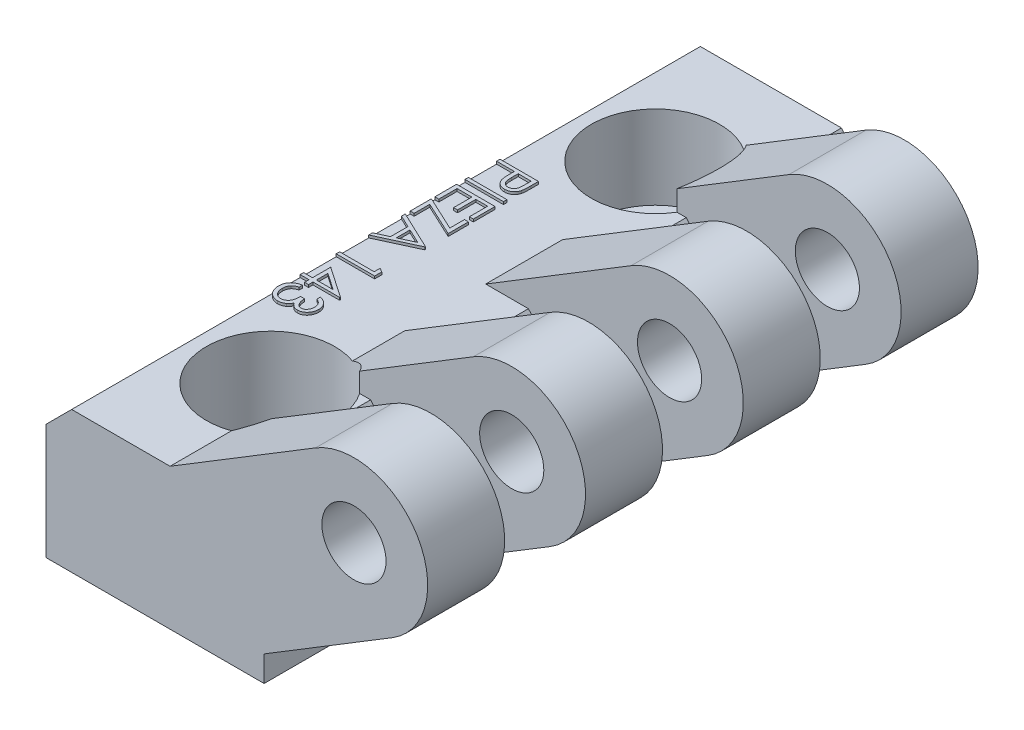
from build123d import *

# Parameters (mm, degrees)
SALIENTE_EXTRUIR1_DEPTH    = 24.5
CROQUIS11_R                = 2.5
SALIENTE_EXTRUIR4_DEPTH    = 6
MATRIZL1_COUNT             = 4
MATRIZL1_PITCH             = 12.3
CROQUIS12_R                = 2.75
CORTAR_EXTRUIR3_DEPTH      = 40.087242164
CORTAR_EXTRUIR4_DEPTH      = 6.5
CORTAR_EXTRUIR4_DEPTH_BACK = 6.5
CROQUIS13_R                = 5
CROQUIS14_W                = 0.224358974
CROQUIS14_H                = 2.5
CROQUIS14_W_2              = 0.961538461
CROQUIS14_H_2              = 0.256410257
CROQUIS14_W_3              = 0.224358975
SALIENTE_EXTRUIR5_DEPTH    = 0.2
CROQUIS15_W                = 3
CROQUIS15_H                = 0.269230769
SALIENTE_EXTRUIR6_DEPTH    = 0.2


with BuildPart() as part:
    # Croquis2 → Saliente-Extruir1 (new, symmetric)
    with BuildSketch(Plane.XY):
        Polygon((-24, -13), (-7, -13), (-7, -11), (-4.438278679, -9.438723639), (-11, -2), (-22, -2), (-24, -4), align=None)
    extrude(amount=SALIENTE_EXTRUIR1_DEPTH, both=True)

    # Croquis11 → Saliente-Extruir4 (add)
    with BuildSketch(Plane.XY.offset(24.5)):
        with BuildLine():
            Line((-14.330225705, -2), (-11, -2))
            Line((-11, -2), (-4.438278679, -9.438723639))
            Line((-4.438278679, -9.438723639), (2.992446359, -4.909965865))
            ThreePointArc((2.992446359, -4.909965865), (4.909965865, 2.992446359), (-2.992446359, 4.909965865))
            Line((-2.992446359, 4.909965865), (-14.330225705, -2))
        make_face()
        Circle(CROQUIS11_R, mode=Mode.SUBTRACT)
    saliente_extruir4 = extrude(amount=-SALIENTE_EXTRUIR4_DEPTH)

    # MatrizL1: Saliente-Extruir4 ×4
    with Locations(*[(0, 0, -i * MATRIZL1_PITCH) for i in range(1, MATRIZL1_COUNT)]):
        add(saliente_extruir4)

    # Croquis12 → Cortar-Extruir3 (cut, through all)
    with BuildSketch(Plane.XZ.offset(13)):
        with Locations(Location((-16, -15, 0), (0, 0, 270))):
            Circle(CROQUIS12_R)
        with Locations(Location((-16, 15, 0), (0, 0, 270))):
            Circle(CROQUIS12_R)
    extrude(amount=-CORTAR_EXTRUIR3_DEPTH, mode=Mode.SUBTRACT)

    # Croquis13 → Cortar-Extruir4 (cut, two sides: drawn at the far end of the back side and taken through both)
    with BuildSketch(Plane(origin=(0, -2, 0), x_dir=(1, 0, 0), z_dir=(0, 1, 0)).offset(-CORTAR_EXTRUIR4_DEPTH_BACK)):
        with Locations(Location((-16, 15, 0), (0, 0, 42.843643044))):
            Circle(CROQUIS13_R)
        with Locations(Location((-16, -15, 0), (0, 0, 70.491004008))):
            Circle(CROQUIS13_R)
    extrude(amount=CORTAR_EXTRUIR4_DEPTH + CORTAR_EXTRUIR4_DEPTH_BACK, mode=Mode.SUBTRACT)

    # Croquis14 → Saliente-Extruir5 (add)
    # profile 1 of 19: a face of its own
    with BuildSketch(Plane.ZY.offset(24)):
        with BuildLine():
            Line((-22.54318198, -7.111793071), (-22.052897525, -7.111793071))
            add(Edge.make_bspline(
                [(-22.052897525, -7.111793071), (-22.019175449, -7.11183014), (-21.954562455, -7.111901165), (-21.861908843, -7.114054555), (-21.777759035, -7.116930764), (-21.702294477, -7.12091783), (-21.635282979, -7.125629681), (-21.577027765, -7.13223828), (-21.527070939, -7.139138491), (-21.49713776, -7.146153782), (-21.483486467, -7.149353167)],
                knots=[0, 0, 0, 0, 1.415646017, 2.712440637, 3.8905458, 4.950247383, 5.884950622, 6.709939814, 7.411656543, 8, 8, 8, 8], degree=3))
            add(Edge.make_bspline(
                [(-21.483486467, -7.149353167), (-21.466205372, -7.154083131), (-21.432050388, -7.163431604), (-21.382835357, -7.182155692), (-21.336011182, -7.204357239), (-21.291417212, -7.229660053), (-21.249601438, -7.259149742), (-21.20993998, -7.291630897), (-21.172782852, -7.327853446), (-21.138339, -7.367411118), (-21.106707002, -7.409639839), (-21.079471514, -7.455170003), (-21.056666352, -7.50323522), (-21.037106872, -7.553802056), (-21.023029405, -7.607295145), (-21.012424477, -7.663342796), (-21.005693314, -7.721939004), (-21.005048627, -7.761981766), (-21.004720442, -7.782365988)],
                knots=[0, 0, 0, 0, 0.999701418, 1.975846123, 2.934577507, 3.890451536, 4.834027766, 5.787354733, 6.749476667, 7.726910423, 8.712836071, 9.690891519, 10.682875813, 11.679750201, 12.712814741, 13.765529915, 14.8625177, 16, 16, 16, 16], degree=3))
            add(Edge.make_bspline(
                [(-21.004720442, -7.782365988), (-21.00502146, -7.802921543), (-21.005610421, -7.843139874), (-21.012679196, -7.90197758), (-21.022200762, -7.958205001), (-21.036841513, -8.011697466), (-21.056016994, -8.062137302), (-21.078511317, -8.110295325), (-21.105642411, -8.155352233), (-21.136817289, -8.197471603), (-21.171496999, -8.236692969), (-21.209534812, -8.272732108), (-21.250777164, -8.305378064), (-21.295092984, -8.334704024), (-21.342914305, -8.360029938), (-21.393515843, -8.382713727), (-21.447337426, -8.401764485), (-21.484582079, -8.411785957), (-21.503518519, -8.416881212)],
                knots=[0, 0, 0, 0, 1.121902311, 2.195077645, 3.232258892, 4.234102512, 5.217864754, 6.176164875, 7.132989551, 8.084763148, 9.034132444, 9.988522005, 10.94243251, 11.903244335, 12.886203696, 13.894208494, 14.929344452, 16, 16, 16, 16], degree=3))
            add(Edge.make_bspline(
                [(-21.503518519, -8.416881212), (-21.5191809, -8.420211913), (-21.55350592, -8.427511337), (-21.610036436, -8.435660235), (-21.675854568, -8.442615664), (-21.750870483, -8.447830762), (-21.835016843, -8.452295311), (-21.92833917, -8.45584395), (-22.031020654, -8.457793845), (-22.102642971, -8.457894412), (-22.140036948, -8.457946917)],
                knots=[0, 0, 0, 0, 0.601384939, 1.31797006, 2.144135048, 3.087295005, 4.142315834, 5.309527816, 6.595305764, 8, 8, 8, 8], degree=3))
            Line((-22.140036948, -8.457946917), (-22.318823006, -8.457946917))
            Line((-22.318823006, -8.457946917), (-22.318823006, -9.611793071))
            Line((-22.318823006, -9.611793071), (-22.54318198, -9.611793071))
            Line((-22.54318198, -9.611793071), (-22.54318198, -7.111793071))
        make_face()
        with BuildLine():
            Line((-22.318823006, -7.368203328), (-22.318823006, -8.201536661))
            Line((-22.318823006, -8.201536661), (-21.881122685, -8.207045475))
            add(Edge.make_bspline(
                [(-21.881122685, -8.207045475), (-21.85975131, -8.20705652), (-21.81849431, -8.207077843), (-21.758897008, -8.204231255), (-21.70360466, -8.20094516), (-21.652787106, -8.196133787), (-21.606421438, -8.189332888), (-21.564430346, -8.182467361), (-21.52713943, -8.172534959), (-21.483497143, -8.159161339), (-21.43486618, -8.136352327), (-21.381960789, -8.103245263), (-21.337124655, -8.061044757), (-21.298325872, -8.013596306), (-21.267535959, -7.960811214), (-21.244995965, -7.904333402), (-21.231752281, -7.844742081), (-21.229976428, -7.803964839), (-21.229079416, -7.78336759)],
                knots=[0, 0, 0, 0, 1.160613943, 2.240541288, 3.23993089, 4.169200891, 5.011653406, 5.7853311, 6.478053781, 7.106038997, 8.262395093, 9.384106736, 10.481365981, 11.59014053, 12.70357646, 13.786202915, 14.881775077, 16, 16, 16, 16], degree=3))
            add(Edge.make_bspline(
                [(-21.229079416, -7.78336759), (-21.229981307, -7.763268652), (-21.231774153, -7.723314451), (-21.24509977, -7.664758193), (-21.267492137, -7.608875547), (-21.298532561, -7.556751915), (-21.336204797, -7.509474198), (-21.379990042, -7.468404821), (-21.429785229, -7.435389319), (-21.476105394, -7.414079832), (-21.517249098, -7.401068921), (-21.552986212, -7.391965464), (-21.593336694, -7.384697174), (-21.638313679, -7.378811814), (-21.687568561, -7.373773628), (-21.7415245, -7.370355073), (-21.799977102, -7.368354033), (-21.840556081, -7.368254779), (-21.861591435, -7.368203328)],
                knots=[0, 0, 0, 0, 1.120700087, 2.227813068, 3.331159281, 4.466773991, 5.599788987, 6.693661531, 7.80175334, 8.91857717, 9.525282508, 10.207424825, 10.974604443, 11.810962634, 12.737642355, 13.736264703, 14.826523623, 16, 16, 16, 16], degree=3))
            Line((-21.861591435, -7.368203328), (-22.318823006, -7.368203328))
        make_face(mode=Mode.SUBTRACT)
    # profile 2 of 19: a face of its own
    with BuildSketch(Plane.ZY.offset(24)):
        with Locations((-19.745105057, -8.361793071)):
            Rectangle(CROQUIS14_W, CROQUIS14_H)
    # profile 3 of 19: a face of its own
    with BuildSketch(Plane.ZY.offset(24)):
        Polygon((-17.331643519, -7.111793071), (-16.177797365, -9.611793071), (-16.421687589, -9.611793071), (-16.791278935, -8.81051102), (-17.924592237, -8.81051102), (-18.30470041, -9.611793071), (-18.549592237, -9.611793071), (-17.363694801, -7.111793071), align=None)
        Polygon((-17.350173166, -7.599072719), (-17.802897525, -8.554100763), (-16.909468038, -8.554100763), align=None, mode=Mode.SUBTRACT)
    # profile 4 of 19: a face of its own
    with BuildSketch(Plane.ZY.offset(24)):
        Polygon((-15.22266916, -7.368203328), (-15.22266916, -7.111793071), (-13.908566596, -7.111793071), (-14.95724448, -9.355382815), (-13.940617878, -9.355382815), (-13.940617878, -9.611793071), (-15.318823006, -9.611793071), (-14.270145121, -7.368203328), align=None)
    # profile 5 of 19: a face of its own
    with BuildSketch(Plane.ZY.offset(24)):
        Polygon((-11.197028134, -7.111793071), (-10.97266916, -7.111793071), (-10.97266916, -9.355382815), (-10.011130698, -9.355382815), (-10.011130698, -9.611793071), (-11.197028134, -9.611793071), align=None)
    # profile 6 of 19: a face of its own
    with BuildSketch(Plane.ZY.offset(24)):
        Polygon((-9.248310185, -7.368203328), (-9.248310185, -7.111793071), (-7.934207621, -7.111793071), (-7.934207621, -7.368203328), (-8.479079416, -7.368203328), (-8.479079416, -9.611793071), (-8.703438391, -9.611793071), (-8.703438391, -7.368203328), align=None)
    # profile 7 of 19: a face of its own
    with BuildSketch(Plane.ZY.offset(24)):
        with Locations((-6.658566595, -8.650254609)):
            Rectangle(CROQUIS14_W_2, CROQUIS14_H_2)
    # profile 8 of 19: a face of its own
    with BuildSketch(Plane.ZY.offset(24)):
        Polygon((-4.819524128, -7.111793071), (-4.357284544, -7.111793071), (-4.357284544, -9.611793071), (-4.581643519, -9.611793071), (-4.581643519, -7.368203328), (-4.966258903, -7.368203328), align=None)
    # profile 9 of 19: a face of its own
    with BuildSketch(Plane.ZY.offset(24)):
        with Locations((-2.456643519, -8.361793071)):
            Rectangle(CROQUIS14_W, CROQUIS14_H)
    # profile 10 of 19: a face of its own
    with BuildSketch(Plane.ZY.offset(24)):
        with Locations((-0.81241275, -8.650254609)):
            Rectangle(CROQUIS14_W_2, CROQUIS14_H_2)
    # profile 11 of 19: a face of its own
    with BuildSketch(Plane.ZY.offset(24)):
        with BuildLine():
            Line((0.719638533, -7.111793071), (1.207418981, -7.111793071))
            add(Edge.make_bspline(
                [(1.207418981, -7.111793071), (1.231296466, -7.111918607), (1.277576973, -7.112161927), (1.344876574, -7.115935592), (1.407911439, -7.121081071), (1.466699848, -7.129245423), (1.521214635, -7.139096692), (1.57162009, -7.151026561), (1.617755928, -7.165331285), (1.672836454, -7.188078628), (1.735636926, -7.221880892), (1.803635778, -7.271829867), (1.861781663, -7.332924483), (1.911914747, -7.401840666), (1.951772689, -7.477651931), (1.980607902, -7.558551352), (1.998863527, -7.643495453), (2.00074098, -7.701812009), (2.001689815, -7.731284257)],
                knots=[0, 0, 0, 0, 1.001505555, 1.941167018, 2.826882275, 3.653841531, 4.429895133, 5.150066043, 5.825578002, 6.45369114, 7.647487171, 8.808567382, 9.977351308, 11.170798116, 12.373658725, 13.556498008, 14.765093433, 16, 16, 16, 16], degree=3))
            add(Edge.make_bspline(
                [(2.001689815, -7.731284257), (2.000908944, -7.758893225), (1.99937446, -7.813147452), (1.984701061, -7.892500387), (1.961729155, -7.968036972), (1.929796834, -8.039481533), (1.888295408, -8.105219828), (1.839110895, -8.165782161), (1.779770322, -8.218604344), (1.735310865, -8.248134989), (1.712727475, -8.263135219)],
                knots=[0, 0, 0, 0, 1.044552857, 2.05264487, 3.044412934, 4.028983338, 5.005914585, 5.980388656, 6.974128949, 8, 8, 8, 8], degree=3))
            add(Edge.make_bspline(
                [(1.712727475, -8.263135219), (1.74112778, -8.274038789), (1.7954646, -8.294900021), (1.870240323, -8.331782495), (1.934665212, -8.371898288), (1.989234602, -8.415706753), (2.035904356, -8.462927332), (2.076656457, -8.514252414), (2.111428867, -8.570351526), (2.141223812, -8.630639766), (2.164472924, -8.694501529), (2.181884284, -8.761337798), (2.191861033, -8.830908908), (2.193280777, -8.878255608), (2.193997507, -8.902157654)],
                knots=[0, 0, 0, 0, 1.27268992, 2.434971085, 3.483601985, 4.442670788, 5.356604649, 6.2567628, 7.179492994, 8.113709626, 9.066344395, 10.018646069, 10.999752585, 12, 12, 12, 12], degree=3))
            add(Edge.make_bspline(
                [(2.193997507, -8.902157654), (2.19329976, -8.926562563), (2.191926923, -8.974579905), (2.181798371, -9.045119286), (2.164649009, -9.112529963), (2.141026762, -9.17724795), (2.110196537, -9.239148046), (2.072676563, -9.298300378), (2.027939731, -9.354110614), (1.977894825, -9.407198916), (1.921279007, -9.45493305), (1.860196325, -9.497444269), (1.793877525, -9.532405742), (1.723411815, -9.561774329), (1.648008732, -9.584208042), (1.568006869, -9.599902738), (1.483475225, -9.610477764), (1.42546826, -9.611347196), (1.395720263, -9.611793071)],
                knots=[0, 0, 0, 0, 0.978564426, 1.925352924, 2.850884081, 3.763762016, 4.682927383, 5.618979971, 6.567305752, 7.547517671, 8.540179244, 9.531824382, 10.526200242, 11.540722885, 12.589160233, 13.674978461, 14.80764778, 16, 16, 16, 16], degree=3))
            Line((1.395720263, -9.611793071), (0.719638533, -9.611793071))
            Line((0.719638533, -9.611793071), (0.719638533, -7.111793071))
        make_face()
        with BuildLine():
            Line((0.943997507, -7.368203328), (0.943997507, -8.169485379))
            Line((0.943997507, -8.169485379), (1.094738693, -8.169485379))
            add(Edge.make_bspline(
                [(1.094738693, -8.169485379), (1.116773547, -8.16919972), (1.159349375, -8.168647768), (1.221006444, -8.167066684), (1.278238599, -8.16263951), (1.330947052, -8.158213609), (1.379048797, -8.151017475), (1.42243727, -8.142451673), (1.461793411, -8.133392455), (1.5071788, -8.117985678), (1.558659478, -8.09521591), (1.613540266, -8.059878884), (1.66192203, -8.017790061), (1.702777164, -7.969225088), (1.736213929, -7.915749241), (1.759438011, -7.858215755), (1.775186071, -7.798058518), (1.776608594, -7.756759766), (1.77733084, -7.735791469)],
                knots=[0, 0, 0, 0, 1.156816544, 2.235205308, 3.236616184, 4.169592532, 5.011045266, 5.787822928, 6.49130361, 7.128639758, 8.301311294, 9.436451833, 10.541879658, 11.654887649, 12.756523258, 13.837046038, 14.901820046, 16, 16, 16, 16], degree=3))
            add(Edge.make_bspline(
                [(1.77733084, -7.735791469), (1.776954997, -7.721915917), (1.77621774, -7.694697509), (1.770179667, -7.655019399), (1.759917114, -7.617702433), (1.746735476, -7.582235211), (1.728314984, -7.549726747), (1.706626796, -7.519053035), (1.680422731, -7.491258665), (1.650596079, -7.465280452), (1.616304206, -7.442248646), (1.577567569, -7.422076673), (1.533862085, -7.405833261), (1.485924332, -7.391607438), (1.433016412, -7.381615799), (1.375748874, -7.373291951), (1.313652646, -7.369054278), (1.270691858, -7.368493304), (1.248484686, -7.368203328)],
                knots=[0, 0, 0, 0, 0.91205012, 1.789085906, 2.630437955, 3.453916878, 4.269457761, 5.079663411, 5.91843418, 6.774407191, 7.675494373, 8.627863946, 9.638891023, 10.736472738, 11.911756761, 13.175263542, 14.539845004, 16, 16, 16, 16], degree=3))
            Line((1.248484686, -7.368203328), (0.943997507, -7.368203328))
        make_face(mode=Mode.SUBTRACT)
        with BuildLine():
            Line((0.943997507, -8.425895635), (0.943997507, -9.355382815))
            Line((0.943997507, -9.355382815), (1.263508725, -9.355382815))
            add(Edge.make_bspline(
                [(1.263508725, -9.355382815), (1.286379386, -9.355108709), (1.330459571, -9.354580408), (1.394103307, -9.352855726), (1.453091238, -9.348932672), (1.507154192, -9.342757065), (1.556875944, -9.336058173), (1.601660018, -9.327050115), (1.641869441, -9.316729429), (1.688493947, -9.300776449), (1.740996453, -9.275993255), (1.797575636, -9.23862595), (1.847880078, -9.194109302), (1.89059812, -9.14258722), (1.925607397, -9.086564844), (1.95107558, -9.027175308), (1.966783334, -8.965399932), (1.968684884, -8.923280851), (1.969638533, -8.902157654)],
                knots=[0, 0, 0, 0, 1.160039823, 2.235823828, 3.228722157, 4.157150951, 4.99529583, 5.772374946, 6.472645482, 7.099169577, 8.269452708, 9.405989375, 10.527446681, 11.663510218, 12.788923519, 13.866172445, 14.929861265, 16, 16, 16, 16], degree=3))
            add(Edge.make_bspline(
                [(1.969638533, -8.902157654), (1.969441315, -8.888948126), (1.969050061, -8.862742139), (1.963149622, -8.824230839), (1.954568287, -8.786926644), (1.943474405, -8.750728258), (1.927317643, -8.716290132), (1.908455825, -8.682931161), (1.886340538, -8.650607247), (1.85188042, -8.609741352), (1.801757574, -8.562657771), (1.730538448, -8.516559555), (1.649558236, -8.47938255), (1.590824312, -8.46359721), (1.560483885, -8.455442911)],
                knots=[0, 0, 0, 0, 0.723448775, 1.435228256, 2.130040452, 2.821711965, 3.505591119, 4.210454504, 4.921174351, 5.648778258, 7.137944449, 8.670945889, 10.280296675, 12, 12, 12, 12], degree=3))
            add(Edge.make_bspline(
                [(1.560483885, -8.455442911), (1.548320245, -8.452974994), (1.521946965, -8.44762404), (1.47894155, -8.441975681), (1.429844501, -8.436943495), (1.374542446, -8.43322124), (1.312965417, -8.429373709), (1.244981903, -8.427877408), (1.170869536, -8.426092222), (1.119446412, -8.42596284), (1.092735488, -8.425895635)],
                knots=[0, 0, 0, 0, 0.634451884, 1.375622551, 2.216452059, 3.157844607, 4.20941857, 5.370758133, 6.634282058, 8, 8, 8, 8], degree=3))
            Line((1.092735488, -8.425895635), (0.943997507, -8.425895635))
        make_face(mode=Mode.SUBTRACT)
    # profile 12 of 19: a face of its own
    with BuildSketch(Plane.ZY.offset(24)):
        with Locations((3.453612892, -8.361793071)):
            Rectangle(CROQUIS14_W_3, CROQUIS14_H)
    # profile 13 of 19: a face of its own
    with BuildSketch(Plane.ZY.offset(24)):
        with BuildLine():
            Line((4.585023148, -9.129521437), (4.796361289, -9.002818712))
            add(Edge.make_bspline(
                [(4.796361289, -9.002818712), (4.816017173, -9.035721844), (4.853677087, -9.098762976), (4.916499487, -9.18394729), (4.981594423, -9.256348831), (5.049443947, -9.315546408), (5.11963391, -9.362152755), (5.19262252, -9.395154349), (5.268163813, -9.415737189), (5.319573686, -9.418237251), (5.345239494, -9.419485379)],
                knots=[0, 0, 0, 0, 1.272034388, 2.437168799, 3.508375237, 4.49857839, 5.41946034, 6.295179144, 7.148887113, 8, 8, 8, 8], degree=3))
            add(Edge.make_bspline(
                [(5.345239494, -9.419485379), (5.36715868, -9.418874898), (5.410613518, -9.41766462), (5.474586549, -9.406035475), (5.536716407, -9.388169669), (5.595722577, -9.362583289), (5.650790873, -9.331627228), (5.69908137, -9.294237101), (5.740828594, -9.252375526), (5.774977961, -9.20567363), (5.801177986, -9.155447095), (5.821315178, -9.103892844), (5.832490231, -9.05020101), (5.834173626, -9.014050679), (5.835023148, -8.995807494)],
                knots=[0, 0, 0, 0, 1.095163259, 2.171163733, 3.241058638, 4.321873601, 5.38011039, 6.391990106, 7.366004449, 8.327778327, 9.272591725, 10.192022065, 11.087607919, 12, 12, 12, 12], degree=3))
            add(Edge.make_bspline(
                [(5.835023148, -8.995807494), (5.833970069, -8.974992602), (5.831829313, -8.932678966), (5.813735399, -8.870250643), (5.785271651, -8.808470236), (5.75901262, -8.770255046), (5.745379718, -8.750414866)],
                knots=[0, 0, 0, 0, 0.938893495, 1.908633276, 2.914225137, 4, 4, 4, 4], degree=3))
            add(Edge.make_bspline(
                [(5.745379718, -8.750414866), (5.734186423, -8.736095706), (5.710687498, -8.706034422), (5.670289275, -8.661287825), (5.622884907, -8.615131811), (5.570096654, -8.565803913), (5.51000159, -8.515598344), (5.444481937, -8.462121003), (5.371864895, -8.407405591), (5.320936683, -8.370710901), (5.294658565, -8.351777046)],
                knots=[0, 0, 0, 0, 0.722233717, 1.516239348, 2.393582979, 3.351407094, 4.387010283, 5.505090956, 6.712668013, 8, 8, 8, 8], degree=3))
            add(Edge.make_bspline(
                [(5.294658565, -8.351777046), (5.26835571, -8.33304234), (5.218066655, -8.29722301), (5.147739097, -8.244062807), (5.084850194, -8.195460043), (5.029679468, -8.150957177), (4.982251185, -8.110548174), (4.942191606, -8.074621075), (4.910521208, -8.042204245), (4.892910079, -8.021174715), (4.885003116, -8.011732975)],
                knots=[0, 0, 0, 0, 1.452282411, 2.77665338, 3.964542531, 5.026858415, 5.96415736, 6.766646006, 7.446254459, 8, 8, 8, 8], degree=3))
            add(Edge.make_bspline(
                [(4.885003116, -8.011732975), (4.873951298, -7.997017949), (4.852216414, -7.968078875), (4.823526411, -7.922846833), (4.799141294, -7.876544501), (4.780025343, -7.829047455), (4.763928044, -7.781022506), (4.75310095, -7.731843044), (4.746321381, -7.681729745), (4.745627105, -7.648005816), (4.745279558, -7.631124001)],
                knots=[0, 0, 0, 0, 1.068054152, 2.10047183, 3.106115577, 4.101338837, 5.06977816, 6.043150881, 7.020423561, 8, 8, 8, 8], degree=3))
            add(Edge.make_bspline(
                [(4.745279558, -7.631124001), (4.74621185, -7.604674162), (4.748056507, -7.55233983), (4.763656877, -7.475889237), (4.788280372, -7.402898939), (4.822776721, -7.334091558), (4.867246259, -7.271258715), (4.918707669, -7.213677652), (4.980001588, -7.165271522), (5.047253461, -7.122977195), (5.120865156, -7.089872963), (5.198001515, -7.064900834), (5.278785138, -7.050751364), (5.333501663, -7.048720818), (5.361265135, -7.047690507)],
                knots=[0, 0, 0, 0, 1.005424448, 1.989358655, 2.955360095, 3.929531133, 4.905563448, 5.876582895, 6.856512386, 7.866279853, 8.892233794, 9.918561126, 10.94386622, 12, 12, 12, 12], degree=3))
            add(Edge.make_bspline(
                [(5.361265135, -7.047690507), (5.390725207, -7.048706615), (5.449311887, -7.05072733), (5.535489898, -7.068296996), (5.618461838, -7.097368904), (5.685207027, -7.130360803), (5.737444714, -7.163311814), (5.77728238, -7.193325974), (5.817651988, -7.227879623), (5.85887917, -7.267064799), (5.900265355, -7.31124105), (5.942424964, -7.360105827), (5.985456584, -7.41336051), (6.013139342, -7.451378011), (6.02733084, -7.47086759)],
                knots=[0, 0, 0, 0, 1.286793592, 2.559021753, 3.825965368, 5.121522368, 5.803751409, 6.523245864, 7.299691795, 8.125521123, 9.008227632, 9.944561021, 10.946284179, 12, 12, 12, 12], degree=3))
            Line((6.02733084, -7.47086759), (5.824506321, -7.624613584))
            add(Edge.make_bspline(
                [(5.824506321, -7.624613584), (5.812259226, -7.608835948), (5.788674186, -7.57845191), (5.752867409, -7.53590097), (5.719118375, -7.497032056), (5.685868089, -7.463271251), (5.654872638, -7.432769727), (5.624789037, -7.406655615), (5.596050214, -7.384673047), (5.55982385, -7.361213361), (5.514311194, -7.337958715), (5.457179382, -7.318280803), (5.3974749, -7.306455758), (5.356810878, -7.304892267), (5.336225071, -7.304100763)],
                knots=[0, 0, 0, 0, 1.181633172, 2.275549214, 3.290209073, 4.226197932, 5.078386478, 5.862611352, 6.581680152, 7.217281963, 8.414376989, 9.595101626, 10.782541182, 12, 12, 12, 12], degree=3))
            add(Edge.make_bspline(
                [(5.336225071, -7.304100763), (5.310398984, -7.304966263), (5.260595807, -7.306635299), (5.189888495, -7.324863859), (5.126249977, -7.353565188), (5.071569574, -7.393790173), (5.026043162, -7.441448025), (4.993110691, -7.496290064), (4.973289145, -7.556848923), (4.970870374, -7.599092963), (4.969638533, -7.620607174)],
                knots=[0, 0, 0, 0, 1.14458467, 2.207223713, 3.21896685, 4.227309161, 5.202851033, 6.127160689, 7.046193047, 8, 8, 8, 8], degree=3))
            add(Edge.make_bspline(
                [(4.969638533, -7.620607174), (4.969919337, -7.634001087), (4.970481406, -7.660810815), (4.978320547, -7.700418974), (4.988391496, -7.739927073), (5.004350519, -7.77915749), (5.026382879, -7.818796317), (5.055315147, -7.85952613), (5.091753227, -7.901705922), (5.119665379, -7.92913976), (5.134402154, -7.943624001)],
                knots=[0, 0, 0, 0, 0.858281714, 1.717966888, 2.583508476, 3.4729293, 4.427298488, 5.488583878, 6.674047936, 8, 8, 8, 8], degree=3))
            add(Edge.make_bspline(
                [(5.134402154, -7.943624001), (5.139874563, -7.94850759), (5.152875754, -7.960109882), (5.176644272, -7.979104368), (5.208031985, -8.00253492), (5.246219272, -8.03152586), (5.291910245, -8.065155476), (5.345109928, -8.102993771), (5.405225308, -8.146269098), (5.44788382, -8.176524485), (5.470439815, -8.192522238)],
                knots=[0, 0, 0, 0, 0.420754252, 0.999615792, 1.744751191, 2.668019286, 3.750313428, 4.999500688, 6.413464383, 8, 8, 8, 8], degree=3))
            add(Edge.make_bspline(
                [(5.470439815, -8.192522238), (5.49757261, -8.212266066), (5.550111507, -8.250497253), (5.624866921, -8.307937024), (5.692648213, -8.364114002), (5.753693358, -8.418669436), (5.808605436, -8.471189502), (5.856775236, -8.522306059), (5.898693579, -8.571652897), (5.943821593, -8.634919023), (5.989934321, -8.712619797), (6.029535398, -8.807818539), (6.054505646, -8.903387339), (6.057771014, -8.967620794), (6.059382122, -8.999313103)],
                knots=[0, 0, 0, 0, 1.163667725, 2.253281268, 3.268753668, 4.215851969, 5.092017293, 5.902905408, 6.650798638, 7.335211899, 8.59617414, 9.77448103, 10.901945474, 12, 12, 12, 12], degree=3))
            add(Edge.make_bspline(
                [(6.059382122, -8.999313103), (6.058912738, -9.021726221), (6.057983084, -9.066117209), (6.047296717, -9.131299407), (6.031639814, -9.194607171), (6.008041789, -9.255257966), (5.979239533, -9.314361368), (5.942692214, -9.370367011), (5.900329582, -9.424514438), (5.851734035, -9.475359789), (5.798558391, -9.522035644), (5.742355752, -9.563556402), (5.683034128, -9.598176633), (5.62091533, -9.626427234), (5.55598509, -9.648522604), (5.488265244, -9.664531796), (5.417644165, -9.674357304), (5.369643821, -9.675377134), (5.345239494, -9.675895635)],
                knots=[0, 0, 0, 0, 0.983748083, 1.948392443, 2.894712957, 3.844097841, 4.80183111, 5.778335162, 6.776009319, 7.81870978, 8.863265674, 9.881300176, 10.883814829, 11.87499822, 12.874611388, 13.892143829, 14.928324115, 16, 16, 16, 16], degree=3))
            add(Edge.make_bspline(
                [(5.345239494, -9.675895635), (5.326357106, -9.675530506), (5.288830135, -9.674804845), (5.233323362, -9.668389644), (5.178937941, -9.659313142), (5.126356311, -9.644903092), (5.074901017, -9.627419537), (5.02479585, -9.605892156), (4.976016525, -9.580094155), (4.92828968, -9.550597709), (4.881736699, -9.516270749), (4.836794222, -9.47628968), (4.79198766, -9.431757176), (4.74863952, -9.381463917), (4.705872989, -9.326222429), (4.664531267, -9.265515869), (4.623758612, -9.199674902), (4.598176135, -9.153342698), (4.585023148, -9.129521437)],
                knots=[0, 0, 0, 0, 0.915332311, 1.819136955, 2.706846663, 3.586547465, 4.459518054, 5.340707479, 6.227863349, 7.133153174, 8.059268498, 9.028702269, 10.047606654, 11.120612155, 12.245963614, 13.433783089, 14.680604001, 16, 16, 16, 16], degree=3))
        make_face()
    # profile 14 of 19: a face of its own
    with BuildSketch(Plane.ZY.offset(24)):
        with BuildLine():
            Line((7.302971866, -7.688716148), (7.078612891, -7.688716148))
            add(Edge.make_bspline(
                [(7.078612891, -7.688716148), (7.084691142, -7.663550088), (7.096573625, -7.614352499), (7.121357606, -7.544061599), (7.148357074, -7.477544798), (7.180777863, -7.416047602), (7.216141258, -7.3583341), (7.256657488, -7.305713297), (7.30045729, -7.256846893), (7.348903682, -7.213480295), (7.399709869, -7.174210488), (7.45359174, -7.140728304), (7.509465236, -7.111925338), (7.567717474, -7.088196601), (7.628521882, -7.070321227), (7.691328756, -7.05735208), (7.756302685, -7.048929856), (7.800408106, -7.048107882), (7.822803597, -7.047690507)],
                knots=[0, 0, 0, 0, 1.162005537, 2.271625781, 3.343758855, 4.383309926, 5.390229558, 6.379919256, 7.361854164, 8.333198761, 9.295911338, 10.242430842, 11.177959212, 12.116337295, 13.062827104, 14.020064771, 14.994644689, 16, 16, 16, 16], degree=3))
            add(Edge.make_bspline(
                [(7.822803597, -7.047690507), (7.855434127, -7.048675672), (7.91998342, -7.050624511), (8.014814168, -7.068420537), (8.106261896, -7.096581346), (8.193325644, -7.135491151), (8.274195953, -7.183482089), (8.346150372, -7.240599758), (8.408213594, -7.305742116), (8.460281007, -7.377693948), (8.501048864, -7.454590741), (8.531110559, -7.53373371), (8.54941176, -7.614935118), (8.551783586, -7.669761746), (8.552971866, -7.69722977)],
                knots=[0, 0, 0, 0, 1.083050992, 2.142477498, 3.193116406, 4.255571735, 5.30263384, 6.308962982, 7.297363603, 8.282367274, 9.249857812, 10.179914175, 11.08814088, 12, 12, 12, 12], degree=3))
            add(Edge.make_bspline(
                [(8.552971866, -7.69722977), (8.552140729, -7.723663195), (8.550514324, -7.775389305), (8.536704535, -7.85090466), (8.513464347, -7.922077232), (8.481271659, -7.989206633), (8.439599123, -8.051867233), (8.389118626, -8.110200012), (8.329473867, -8.164463697), (8.284274626, -8.195549035), (8.261004718, -8.211552687)],
                knots=[0, 0, 0, 0, 1.024540389, 2.004866551, 2.965041327, 3.920577974, 4.882998113, 5.874504559, 6.905732034, 8, 8, 8, 8], degree=3))
            add(Edge.make_bspline(
                [(8.261004718, -8.211552687), (8.287598829, -8.224394238), (8.340289453, -8.249837064), (8.41211126, -8.299734034), (8.477309742, -8.357345711), (8.513669542, -8.402304749), (8.531938212, -8.424894033)],
                knots=[0, 0, 0, 0, 1.015518401, 2.012035669, 3.001164323, 4, 4, 4, 4], degree=3))
            add(Edge.make_bspline(
                [(8.531938212, -8.424894033), (8.543967742, -8.441363855), (8.567829811, -8.474033796), (8.597283764, -8.526559814), (8.624004559, -8.579668021), (8.644826145, -8.634781882), (8.660950335, -8.691262606), (8.672476073, -8.749207175), (8.679636173, -8.808662905), (8.680661568, -8.848886105), (8.681176994, -8.86910477)],
                knots=[0, 0, 0, 0, 1.025084078, 2.033381695, 3.024893161, 4.013698104, 4.991890475, 5.976764909, 6.982997093, 8, 8, 8, 8], degree=3))
            add(Edge.make_bspline(
                [(8.681176994, -8.86910477), (8.679895199, -8.904111714), (8.67733764, -8.973960858), (8.654477587, -9.077157087), (8.619039558, -9.178032446), (8.568713175, -9.274514474), (8.50737924, -9.364786175), (8.434409723, -9.445554967), (8.350633717, -9.514982542), (8.257201111, -9.572989847), (8.15597459, -9.619359792), (8.04770631, -9.65154368), (7.933956272, -9.672505108), (7.855951059, -9.674752871), (7.81629318, -9.675895635)],
                knots=[0, 0, 0, 0, 0.955779014, 1.907060117, 2.875433937, 3.871313158, 4.872415639, 5.851225146, 6.836215519, 7.83643374, 8.849228613, 9.86973379, 10.916971861, 12, 12, 12, 12], degree=3))
            add(Edge.make_bspline(
                [(7.81629318, -9.675895635), (7.789565108, -9.675275483), (7.736973176, -9.67405523), (7.659656392, -9.665713372), (7.585855178, -9.650477654), (7.515469751, -9.629975293), (7.448437582, -9.603981191), (7.384963221, -9.571610693), (7.324656154, -9.533531049), (7.268085475, -9.489292772), (7.215257926, -9.4398061), (7.167577409, -9.384192522), (7.124248986, -9.32348009), (7.086432815, -9.256963622), (7.05240642, -9.185502724), (7.024420023, -9.108182368), (6.999787474, -9.02569378), (6.988334999, -8.96820968), (6.982459045, -8.938716148)],
                knots=[0, 0, 0, 0, 1.048658725, 2.063410685, 3.046034179, 4.001477787, 4.936774919, 5.862367409, 6.792675028, 7.730719943, 8.675894397, 9.627829632, 10.600096036, 11.597688215, 12.626045268, 13.701542398, 14.82072376, 16, 16, 16, 16], degree=3))
            Line((6.982459045, -8.938716148), (7.20681802, -8.938716148))
            add(Edge.make_bspline(
                [(7.20681802, -8.938716148), (7.212663228, -8.957965443), (7.224032665, -8.995406994), (7.243385735, -9.049292927), (7.265434501, -9.098691536), (7.289087757, -9.143965195), (7.313929505, -9.185559768), (7.34172588, -9.222375389), (7.370418126, -9.256029105), (7.392046236, -9.274989542), (7.402631321, -9.284269033)],
                knots=[0, 0, 0, 0, 1.198163088, 2.33053128, 3.407730985, 4.417276592, 5.372219308, 6.28897303, 7.162600585, 8, 8, 8, 8], degree=3))
            add(Edge.make_bspline(
                [(7.402631321, -9.284269033), (7.416628876, -9.2950607), (7.444580778, -9.316610722), (7.490129514, -9.344111886), (7.538033004, -9.367941189), (7.5893292, -9.386143829), (7.642911179, -9.401556444), (7.699645011, -9.411642529), (7.759030166, -9.418562652), (7.799578569, -9.419173317), (7.82029959, -9.419485379)],
                knots=[0, 0, 0, 0, 0.946170439, 1.889420265, 2.845303464, 3.807233317, 4.801018734, 5.828864929, 6.890507805, 8, 8, 8, 8], degree=3))
            add(Edge.make_bspline(
                [(7.82029959, -9.419485379), (7.843694949, -9.419045447), (7.889442554, -9.418185197), (7.956196025, -9.410273978), (8.019701345, -9.398752254), (8.079253435, -9.380957266), (8.135632368, -9.358970944), (8.188047832, -9.33136494), (8.237187908, -9.298975853), (8.282423198, -9.262162168), (8.32309856, -9.2218611), (8.358912498, -9.179708907), (8.389358685, -9.135883314), (8.413918384, -9.090141799), (8.433311634, -9.042673778), (8.44651392, -8.993346043), (8.455693574, -8.942562282), (8.456441154, -8.90804159), (8.45681802, -8.890639225)],
                knots=[0, 0, 0, 0, 1.217147791, 2.380027433, 3.494444702, 4.572153297, 5.609568379, 6.639424714, 7.649109417, 8.668170816, 9.669597737, 10.625200337, 11.543417969, 12.441394052, 13.322311151, 14.205496177, 15.095365482, 16, 16, 16, 16], degree=3))
            add(Edge.make_bspline(
                [(8.45681802, -8.890639225), (8.455724947, -8.867345412), (8.453544241, -8.820873691), (8.436895256, -8.752503995), (8.409510353, -8.686630129), (8.371172845, -8.624375994), (8.324504467, -8.566678921), (8.269958105, -8.515199291), (8.207080799, -8.472720654), (8.149209464, -8.443371614), (8.097948638, -8.423345132), (8.054080506, -8.410005871), (8.004968647, -8.398710403), (7.951206969, -8.388201638), (7.892390386, -8.379257818), (7.82858293, -8.371799378), (7.759771672, -8.365831491), (7.712135125, -8.363166423), (7.68758725, -8.361793071)],
                knots=[0, 0, 0, 0, 1.07054697, 2.135767047, 3.216561865, 4.33974944, 5.486079747, 6.621378074, 7.775625952, 8.963672916, 9.598146892, 10.304877434, 11.070270905, 11.915000392, 12.823868403, 13.805723172, 14.86925407, 16, 16, 16, 16], degree=3))
            Line((7.68758725, -8.361793071), (7.68758725, -8.105382815))
            add(Edge.make_bspline(
                [(7.68758725, -8.105382815), (7.718516655, -8.104857955), (7.779099759, -8.103829884), (7.867595691, -8.09139559), (7.952219486, -8.074195142), (8.03109573, -8.047848576), (8.102987668, -8.017248364), (8.165358812, -7.981639643), (8.217335346, -7.942057679), (8.258664683, -7.897891529), (8.289756989, -7.850523638), (8.312490416, -7.801154597), (8.32591922, -7.749351697), (8.327711839, -7.713998362), (8.328612891, -7.696228167)],
                knots=[0, 0, 0, 0, 1.321986639, 2.589447074, 3.816329219, 5.01088745, 6.139805852, 7.153945165, 8.075214402, 8.924034688, 9.728124013, 10.488707548, 11.240355623, 12, 12, 12, 12], degree=3))
            add(Edge.make_bspline(
                [(8.328612891, -7.696228167), (8.328316884, -7.683172635), (8.32772799, -7.657199273), (8.320301363, -7.619252795), (8.309141334, -7.582466405), (8.29379867, -7.546996541), (8.273262814, -7.513089202), (8.248687109, -7.48045531), (8.21942418, -7.449281182), (8.185891718, -7.420223811), (8.149883286, -7.392531499), (8.110419161, -7.369021758), (8.068689251, -7.348918142), (8.024647354, -7.332339927), (7.978150547, -7.319869007), (7.929417291, -7.310914834), (7.87835466, -7.305316509), (7.843517709, -7.304510498), (7.825808404, -7.304100763)],
                knots=[0, 0, 0, 0, 0.884392785, 1.759457502, 2.611959086, 3.489218968, 4.37281399, 5.2945488, 6.255912374, 7.266815255, 8.301784654, 9.332968512, 10.37626691, 11.440494194, 12.520033166, 13.637162961, 14.798855837, 16, 16, 16, 16], degree=3))
            add(Edge.make_bspline(
                [(7.825808404, -7.304100763), (7.797342927, -7.305094593), (7.74174323, -7.307035775), (7.661589718, -7.324037927), (7.587075908, -7.35116513), (7.530119717, -7.383545858), (7.488060736, -7.415510453), (7.45800578, -7.443426444), (7.42849113, -7.474449889), (7.401458503, -7.510491586), (7.374119948, -7.549110722), (7.349230976, -7.592270494), (7.325045481, -7.638845061), (7.310472232, -7.671770515), (7.302971866, -7.688716148)],
                knots=[0, 0, 0, 0, 1.472543308, 2.876219568, 4.221790263, 5.565193594, 6.249813518, 6.953379497, 7.687249741, 8.463570142, 9.283606569, 10.136032583, 11.040678096, 12, 12, 12, 12], degree=3))
        make_face()
    # profile 15 of 19: a face of its own
    with BuildSketch(Plane.ZY.offset(24)):
        with BuildLine():
            add(Edge.make_bspline(
                [(9.540151353, -8.362794674), (9.540385652, -8.322725111), (9.54084078, -8.244889408), (9.545903938, -8.131471807), (9.554314897, -8.0250716), (9.565841592, -7.925683696), (9.579868721, -7.833282435), (9.598594068, -7.748114752), (9.619888927, -7.669786461), (9.644569246, -7.598042141), (9.672417666, -7.53191521), (9.702727852, -7.470182924), (9.736702706, -7.412938686), (9.772400501, -7.359268836), (9.811266266, -7.310051911), (9.852193974, -7.264592866), (9.896781028, -7.22394233), (9.943511748, -7.186909257), (9.992809223, -7.154445349), (10.04326827, -7.125850536), (10.095236203, -7.101422059), (10.148854905, -7.082214605), (10.203642446, -7.066349714), (10.259790351, -7.055500466), (10.317391325, -7.048674103), (10.356270921, -7.048021483), (10.375988693, -7.047690507)],
                knots=[0, 0, 0, 0, 1.646270934, 3.197905019, 4.663502075, 6.030701355, 7.308322542, 8.50163776, 9.611534131, 10.641858119, 11.616356847, 12.558055219, 13.465016945, 14.349605745, 15.204443733, 16.039544428, 16.859896111, 17.680448484, 18.487036065, 19.28249412, 20.06191084, 20.843045899, 21.620316918, 22.403196591, 23.190181807, 24, 24, 24, 24], degree=3))
            add(Edge.make_bspline(
                [(10.375988693, -7.047690507), (10.395871177, -7.048038946), (10.435411184, -7.048731883), (10.493868595, -7.055391842), (10.55097551, -7.066442644), (10.606488466, -7.082100483), (10.660863457, -7.101525966), (10.713675176, -7.125873907), (10.765251663, -7.154215955), (10.814773297, -7.187518725), (10.862783737, -7.224648922), (10.90810371, -7.266622257), (10.950737343, -7.313014913), (10.991219704, -7.363330531), (11.028402274, -7.418534163), (11.063811868, -7.47766567), (11.095506179, -7.541759144), (11.126030947, -7.609745193), (11.152378795, -7.683504949), (11.176140399, -7.762622635), (11.195339662, -7.848032769), (11.211331999, -7.93928723), (11.223721211, -8.036721146), (11.232744527, -8.140125657), (11.237511016, -8.249568793), (11.23840866, -8.324395829), (11.238869302, -8.362794674)],
                knots=[0, 0, 0, 0, 0.810914788, 1.612654377, 2.396697861, 3.181598691, 3.963628158, 4.749916497, 5.551656086, 6.361998678, 7.18212741, 8.025565596, 8.878627764, 9.750805457, 10.657531673, 11.591944965, 12.560506719, 13.57287815, 14.630710178, 15.753379473, 16.941251878, 18.199788006, 19.531962791, 20.947069417, 22.433333509, 24, 24, 24, 24], degree=3))
            add(Edge.make_bspline(
                [(11.238869302, -8.362794674), (11.238403884, -8.401026037), (11.237497037, -8.475518288), (11.232797961, -8.584468985), (11.223541796, -8.68732473), (11.211963233, -8.784332203), (11.195926831, -8.875087645), (11.176208855, -8.959905108), (11.154315767, -9.039150874), (11.127290914, -9.112175739), (11.097711835, -9.179998398), (11.065529552, -9.243332076), (11.031051105, -9.30273657), (10.993487716, -9.35773639), (10.953449563, -9.408721145), (10.910079714, -9.454790875), (10.864600725, -9.497055641), (10.816448999, -9.534663946), (10.766155034, -9.567581664), (10.714755693, -9.597020128), (10.661338991, -9.620757768), (10.607115453, -9.64113994), (10.551309478, -9.656711691), (10.493990627, -9.667478731), (10.435450459, -9.675030051), (10.395877912, -9.675606108), (10.375988693, -9.675895635)],
                knots=[0, 0, 0, 0, 1.561518951, 3.042555995, 4.452378317, 5.7783523, 7.031515105, 8.214008947, 9.334062868, 10.386615937, 11.391082383, 12.354592575, 13.286541444, 14.194233754, 15.072674879, 15.931287219, 16.775624067, 17.606195743, 18.42308326, 19.229000347, 20.022332153, 20.807536673, 21.593273796, 22.3848459, 23.188221202, 24, 24, 24, 24], degree=3))
            add(Edge.make_bspline(
                [(10.375988693, -9.675895635), (10.356271468, -9.675562524), (10.317392951, -9.674905694), (10.259784075, -9.668110172), (10.203868044, -9.657184812), (10.149368934, -9.641887238), (10.096007138, -9.623162355), (10.04450979, -9.598766867), (9.994304302, -9.570671103), (9.945524619, -9.538674373), (9.899087361, -9.502016028), (9.854731215, -9.461470108), (9.813570487, -9.416024814), (9.775260418, -9.366397726), (9.738850355, -9.31304541), (9.705357946, -9.255239429), (9.674378764, -9.193208993), (9.646061985, -9.126553343), (9.620955797, -9.054299823), (9.598778863, -8.975621838), (9.58126875, -8.889824955), (9.566280925, -8.797598265), (9.55419208, -8.698545457), (9.54593899, -8.592612759), (9.540838051, -8.479866181), (9.540384429, -8.402530628), (9.540151353, -8.362794674)],
                knots=[0, 0, 0, 0, 0.810891512, 1.598919785, 2.382837074, 3.152667961, 3.926044502, 4.706494248, 5.493654104, 6.291793342, 7.103789334, 7.925228297, 8.761435821, 9.622817696, 10.50288917, 11.416980706, 12.369136599, 13.353924996, 14.394355917, 15.514179734, 16.714354668, 17.994756427, 19.357759367, 20.818452758, 22.365282078, 24, 24, 24, 24], degree=3))
        make_face()
        with BuildLine():
            add(Edge.make_bspline(
                [(9.764510327, -8.361793071), (9.764595647, -8.395184999), (9.764761235, -8.459992174), (9.769087092, -8.554165932), (9.774980115, -8.642001881), (9.782581042, -8.72361155), (9.793868862, -8.798718701), (9.806516568, -8.867839904), (9.82190806, -8.930609359), (9.840118787, -8.987457795), (9.860860999, -9.039349987), (9.883508045, -9.087636569), (9.907837133, -9.132887952), (9.935065097, -9.174697672), (9.964718714, -9.213202075), (9.996128185, -9.24908267), (10.030465745, -9.281080514), (10.077968418, -9.319456839), (10.140680186, -9.359113363), (10.219694797, -9.393646284), (10.300886547, -9.415348039), (10.355994583, -9.418107864), (10.383500712, -9.419485379)],
                knots=[0, 0, 0, 0, 1.459021318, 2.831673884, 4.118529203, 5.306027144, 6.411944654, 7.436330062, 8.375795394, 9.233974572, 10.042671642, 10.816086306, 11.563610507, 12.285937304, 12.993564865, 13.685989202, 14.367179055, 15.041617293, 16.353048772, 17.594441528, 18.799311195, 20, 20, 20, 20], degree=3))
            add(Edge.make_bspline(
                [(10.383500712, -9.419485379), (10.411184763, -9.418344107), (10.466495708, -9.416063919), (10.547305562, -9.394064821), (10.625755755, -9.360872293), (10.687235712, -9.321624075), (10.734008958, -9.284246696), (10.767521093, -9.252379091), (10.798279699, -9.216696328), (10.82745261, -9.178196831), (10.854209093, -9.136145057), (10.878539905, -9.090743217), (10.900742296, -9.041865233), (10.913391615, -9.007743991), (10.919858885, -8.99029868)],
                knots=[0, 0, 0, 0, 1.353760809, 2.704726607, 4.075137775, 5.516104923, 6.260822281, 7.007110065, 7.778089737, 8.566572457, 9.372053459, 10.217411131, 11.088608312, 12, 12, 12, 12], degree=3))
            add(Edge.make_bspline(
                [(10.919858885, -8.99029868), (10.927395862, -8.967991723), (10.942699158, -8.922699035), (10.962421854, -8.852439283), (10.977954282, -8.778723023), (10.991928114, -8.701990797), (11.001466011, -8.621676725), (11.009143021, -8.538029308), (11.01366494, -8.450985478), (11.014225477, -8.391846198), (11.014510327, -8.361793071)],
                knots=[0, 0, 0, 0, 0.884706709, 1.796334032, 2.740027952, 3.714592787, 4.726048262, 5.777819803, 6.87074269, 8, 8, 8, 8], degree=3))
            add(Edge.make_bspline(
                [(11.014510327, -8.361793071), (11.014117335, -8.331744805), (11.013348558, -8.272963973), (11.010409995, -8.186879558), (11.002821728, -8.105116872), (10.994393786, -8.027323677), (10.981967199, -7.953930604), (10.968568766, -7.884323243), (10.9505679, -7.819363939), (10.931339489, -7.758035667), (10.909332064, -7.701035199), (10.885106539, -7.648096781), (10.859233855, -7.598964834), (10.831132254, -7.553774162), (10.801135338, -7.512322345), (10.768451374, -7.475440492), (10.734376822, -7.441985515), (10.686650261, -7.403797965), (10.624168625, -7.36486104), (10.546421734, -7.329028355), (10.465514131, -7.308451003), (10.410818807, -7.305549798), (10.383500712, -7.304100763)],
                knots=[0, 0, 0, 0, 1.31362396, 2.569729283, 3.763502607, 4.902122613, 5.988968491, 7.01645872, 7.998833611, 8.933434873, 9.825090667, 10.667526885, 11.477055099, 12.250526234, 12.991942729, 13.710640831, 14.402115721, 15.076753259, 16.378508321, 17.609869233, 18.806226677, 20, 20, 20, 20], degree=3))
            add(Edge.make_bspline(
                [(10.383500712, -7.304100763), (10.355850289, -7.305551797), (10.300499071, -7.308456507), (10.218750532, -7.328951688), (10.140390281, -7.364675235), (10.07807387, -7.40392693), (10.030314023, -7.441311438), (9.996683527, -7.473730334), (9.965150547, -7.509191944), (9.93610219, -7.548050454), (9.908895559, -7.589811431), (9.883909121, -7.634803406), (9.861396743, -7.68325438), (9.840622074, -7.735123263), (9.822355797, -7.791966795), (9.807288681, -7.854658933), (9.793369357, -7.923560284), (9.783515594, -7.999074218), (9.774755768, -8.080704328), (9.769126234, -8.168759555), (9.764746764, -8.263091256), (9.764590718, -8.328233512), (9.764510327, -8.361793071)],
                knots=[0, 0, 0, 0, 1.207732386, 2.417664972, 3.655092373, 4.956220595, 5.625982001, 6.301752483, 6.994047911, 7.697131622, 8.419323945, 9.170223765, 9.943494443, 10.752040957, 11.610060368, 12.549350801, 13.567764191, 14.679664412, 15.874934091, 17.154273443, 18.533957287, 20, 20, 20, 20], degree=3))
        make_face(mode=Mode.SUBTRACT)
    # profile 16 of 19: a face of its own
    with BuildSketch(Plane.ZY.offset(24)):
        with BuildLine():
            Line((12.418356481, -7.688716148), (12.193997507, -7.688716148))
            add(Edge.make_bspline(
                [(12.193997507, -7.688716148), (12.200075757, -7.663550088), (12.21195824, -7.614352499), (12.236742221, -7.544061599), (12.263741689, -7.477544798), (12.296162478, -7.416047602), (12.331525874, -7.3583341), (12.372042103, -7.305713297), (12.415841905, -7.256846893), (12.464288298, -7.213480295), (12.515094485, -7.174210488), (12.568976356, -7.140728304), (12.624849851, -7.111925338), (12.683102089, -7.088196601), (12.743906497, -7.070321227), (12.806713371, -7.05735208), (12.8716873, -7.048929856), (12.915792722, -7.048107882), (12.938188212, -7.047690507)],
                knots=[0, 0, 0, 0, 1.162005537, 2.271625781, 3.343758855, 4.383309926, 5.390229558, 6.379919256, 7.361854164, 8.333198761, 9.295911338, 10.242430842, 11.177959212, 12.116337295, 13.062827104, 14.020064771, 14.994644689, 16, 16, 16, 16], degree=3))
            add(Edge.make_bspline(
                [(12.938188212, -7.047690507), (12.970818742, -7.048675672), (13.035368036, -7.050624511), (13.130198783, -7.068420537), (13.221646511, -7.096581346), (13.30871026, -7.135491151), (13.389580569, -7.183482089), (13.461534988, -7.240599758), (13.52359821, -7.305742116), (13.575665622, -7.377693948), (13.616433479, -7.454590741), (13.646495174, -7.53373371), (13.664796375, -7.614935118), (13.667168201, -7.669761746), (13.668356481, -7.69722977)],
                knots=[0, 0, 0, 0, 1.083050992, 2.142477498, 3.193116406, 4.255571735, 5.30263384, 6.308962982, 7.297363603, 8.282367274, 9.249857812, 10.179914175, 11.08814088, 12, 12, 12, 12], degree=3))
            add(Edge.make_bspline(
                [(13.668356481, -7.69722977), (13.667525345, -7.723663195), (13.66589894, -7.775389305), (13.65208915, -7.85090466), (13.628848962, -7.922077232), (13.596656275, -7.989206633), (13.554983739, -8.051867233), (13.504503241, -8.110200012), (13.444858483, -8.164463697), (13.399659241, -8.195549035), (13.376389334, -8.211552687)],
                knots=[0, 0, 0, 0, 1.024540389, 2.004866551, 2.965041327, 3.920577974, 4.882998113, 5.874504559, 6.905732034, 8, 8, 8, 8], degree=3))
            add(Edge.make_bspline(
                [(13.376389334, -8.211552687), (13.402983444, -8.224394238), (13.455674069, -8.249837064), (13.527495875, -8.299734034), (13.592694358, -8.357345711), (13.629054157, -8.402304749), (13.647322827, -8.424894033)],
                knots=[0, 0, 0, 0, 1.015518401, 2.012035669, 3.001164323, 4, 4, 4, 4], degree=3))
            add(Edge.make_bspline(
                [(13.647322827, -8.424894033), (13.659352358, -8.441363855), (13.683214426, -8.474033796), (13.712668379, -8.526559814), (13.739389175, -8.579668021), (13.76021076, -8.634781882), (13.776334951, -8.691262606), (13.787860688, -8.749207175), (13.795020789, -8.808662905), (13.796046183, -8.848886105), (13.796561609, -8.86910477)],
                knots=[0, 0, 0, 0, 1.025084078, 2.033381695, 3.024893161, 4.013698104, 4.991890475, 5.976764909, 6.982997093, 8, 8, 8, 8], degree=3))
            add(Edge.make_bspline(
                [(13.796561609, -8.86910477), (13.795279814, -8.904111714), (13.792722255, -8.973960858), (13.769862202, -9.077157087), (13.734424173, -9.178032446), (13.68409779, -9.274514474), (13.622763856, -9.364786175), (13.549794338, -9.445554967), (13.466018332, -9.514982542), (13.372585726, -9.572989847), (13.271359206, -9.619359792), (13.163090926, -9.65154368), (13.049340887, -9.672505108), (12.971335675, -9.674752871), (12.931677795, -9.675895635)],
                knots=[0, 0, 0, 0, 0.955779014, 1.907060117, 2.875433937, 3.871313158, 4.872415639, 5.851225146, 6.836215519, 7.83643374, 8.849228613, 9.86973379, 10.916971861, 12, 12, 12, 12], degree=3))
            add(Edge.make_bspline(
                [(12.931677795, -9.675895635), (12.904949724, -9.675275483), (12.852357792, -9.67405523), (12.775041007, -9.665713372), (12.701239793, -9.650477654), (12.630854366, -9.629975293), (12.563822197, -9.603981191), (12.500347836, -9.571610693), (12.44004077, -9.533531049), (12.38347009, -9.489292772), (12.330642542, -9.4398061), (12.282962025, -9.384192522), (12.239633601, -9.32348009), (12.20181743, -9.256963622), (12.167791036, -9.185502724), (12.139804638, -9.108182368), (12.115172089, -9.02569378), (12.103719615, -8.96820968), (12.097843661, -8.938716148)],
                knots=[0, 0, 0, 0, 1.048658725, 2.063410685, 3.046034179, 4.001477787, 4.936774919, 5.862367409, 6.792675028, 7.730719943, 8.675894397, 9.627829632, 10.600096036, 11.597688215, 12.626045268, 13.701542398, 14.82072376, 16, 16, 16, 16], degree=3))
            Line((12.097843661, -8.938716148), (12.322202635, -8.938716148))
            add(Edge.make_bspline(
                [(12.322202635, -8.938716148), (12.328047843, -8.957965443), (12.339417281, -8.995406994), (12.358770351, -9.049292927), (12.380819117, -9.098691536), (12.404472373, -9.143965195), (12.42931412, -9.185559768), (12.457110495, -9.222375389), (12.485802742, -9.256029105), (12.507430851, -9.274989542), (12.518015936, -9.284269033)],
                knots=[0, 0, 0, 0, 1.198163088, 2.33053128, 3.407730985, 4.417276592, 5.372219308, 6.28897303, 7.162600585, 8, 8, 8, 8], degree=3))
            add(Edge.make_bspline(
                [(12.518015936, -9.284269033), (12.532013491, -9.2950607), (12.559965393, -9.316610722), (12.60551413, -9.344111886), (12.65341762, -9.367941189), (12.704713816, -9.386143829), (12.758295794, -9.401556444), (12.815029627, -9.411642529), (12.874414782, -9.418562652), (12.914963184, -9.419173317), (12.935684206, -9.419485379)],
                knots=[0, 0, 0, 0, 0.946170439, 1.889420265, 2.845303464, 3.807233317, 4.801018734, 5.828864929, 6.890507805, 8, 8, 8, 8], degree=3))
            add(Edge.make_bspline(
                [(12.935684206, -9.419485379), (12.959079565, -9.419045447), (13.00482717, -9.418185197), (13.071580641, -9.410273978), (13.13508596, -9.398752254), (13.19463805, -9.380957266), (13.251016984, -9.358970944), (13.303432448, -9.33136494), (13.352572524, -9.298975853), (13.397807813, -9.262162168), (13.438483176, -9.2218611), (13.474297114, -9.179708907), (13.504743301, -9.135883314), (13.529302999, -9.090141799), (13.54869625, -9.042673778), (13.561898536, -8.993346043), (13.571078189, -8.942562282), (13.571825769, -8.90804159), (13.572202635, -8.890639225)],
                knots=[0, 0, 0, 0, 1.217147791, 2.380027433, 3.494444702, 4.572153297, 5.609568379, 6.639424714, 7.649109417, 8.668170816, 9.669597737, 10.625200337, 11.543417969, 12.441394052, 13.322311151, 14.205496177, 15.095365482, 16, 16, 16, 16], degree=3))
            add(Edge.make_bspline(
                [(13.572202635, -8.890639225), (13.571109563, -8.867345412), (13.568928856, -8.820873691), (13.552279871, -8.752503995), (13.524894968, -8.686630129), (13.48655746, -8.624375994), (13.439889082, -8.566678921), (13.38534272, -8.515199291), (13.322465414, -8.472720654), (13.264594079, -8.443371614), (13.213333253, -8.423345132), (13.169465122, -8.410005871), (13.120353262, -8.398710403), (13.066591584, -8.388201638), (13.007775001, -8.379257818), (12.943967545, -8.371799378), (12.875156287, -8.365831491), (12.82751974, -8.363166423), (12.802971866, -8.361793071)],
                knots=[0, 0, 0, 0, 1.07054697, 2.135767047, 3.216561865, 4.33974944, 5.486079747, 6.621378074, 7.775625952, 8.963672916, 9.598146892, 10.304877434, 11.070270905, 11.915000392, 12.823868403, 13.805723172, 14.86925407, 16, 16, 16, 16], degree=3))
            Line((12.802971866, -8.361793071), (12.802971866, -8.105382815))
            add(Edge.make_bspline(
                [(12.802971866, -8.105382815), (12.83390127, -8.104857955), (12.894484375, -8.103829884), (12.982980307, -8.09139559), (13.067604101, -8.074195142), (13.146480345, -8.047848576), (13.218372283, -8.017248364), (13.280743428, -7.981639643), (13.332719961, -7.942057679), (13.374049298, -7.897891529), (13.405141604, -7.850523638), (13.427875031, -7.801154597), (13.441303836, -7.749351697), (13.443096455, -7.713998362), (13.443997507, -7.696228167)],
                knots=[0, 0, 0, 0, 1.321986639, 2.589447074, 3.816329219, 5.01088745, 6.139805852, 7.153945165, 8.075214402, 8.924034688, 9.728124013, 10.488707548, 11.240355623, 12, 12, 12, 12], degree=3))
            add(Edge.make_bspline(
                [(13.443997507, -7.696228167), (13.443701499, -7.683172635), (13.443112605, -7.657199273), (13.435685979, -7.619252795), (13.424525949, -7.582466405), (13.409183285, -7.546996541), (13.388647429, -7.513089202), (13.364071725, -7.48045531), (13.334808796, -7.449281182), (13.301276334, -7.420223811), (13.265267902, -7.392531499), (13.225803776, -7.369021758), (13.184073866, -7.348918142), (13.14003197, -7.332339927), (13.093535162, -7.319869007), (13.044801907, -7.310914834), (12.993739276, -7.305316509), (12.958902324, -7.304510498), (12.94119302, -7.304100763)],
                knots=[0, 0, 0, 0, 0.884392785, 1.759457502, 2.611959086, 3.489218968, 4.37281399, 5.2945488, 6.255912374, 7.266815255, 8.301784654, 9.332968512, 10.37626691, 11.440494194, 12.520033166, 13.637162961, 14.798855837, 16, 16, 16, 16], degree=3))
            add(Edge.make_bspline(
                [(12.94119302, -7.304100763), (12.912727543, -7.305094593), (12.857127845, -7.307035775), (12.776974333, -7.324037927), (12.702460523, -7.35116513), (12.645504333, -7.383545858), (12.603445351, -7.415510453), (12.573390395, -7.443426444), (12.543875745, -7.474449889), (12.516843119, -7.510491586), (12.489504564, -7.549110722), (12.464615591, -7.592270494), (12.440430097, -7.638845061), (12.425856847, -7.671770515), (12.418356481, -7.688716148)],
                knots=[0, 0, 0, 0, 1.472543308, 2.876219568, 4.221790263, 5.565193594, 6.249813518, 6.953379497, 7.687249741, 8.463570142, 9.283606569, 10.136032583, 11.040678096, 12, 12, 12, 12], degree=3))
        make_face()
    # profile 17 of 19: a face of its own
    with BuildSketch(Plane.ZY.offset(24)):
        with BuildLine():
            add(Edge.make_bspline(
                [(14.655535968, -8.362794674), (14.655770267, -8.322725111), (14.656225396, -8.244889408), (14.661288553, -8.131471807), (14.669699512, -8.0250716), (14.681226207, -7.925683696), (14.695253336, -7.833282435), (14.713978683, -7.748114752), (14.735273542, -7.669786461), (14.759953861, -7.598042141), (14.787802282, -7.53191521), (14.818112468, -7.470182924), (14.852087321, -7.412938686), (14.887785116, -7.359268836), (14.926650881, -7.310051911), (14.967578589, -7.264592866), (15.012165643, -7.22394233), (15.058896364, -7.186909257), (15.108193838, -7.154445349), (15.158652885, -7.125850536), (15.210620818, -7.101422059), (15.26423952, -7.082214605), (15.319027062, -7.066349714), (15.375174966, -7.055500466), (15.432775941, -7.048674103), (15.471655537, -7.048021483), (15.491373308, -7.047690507)],
                knots=[0, 0, 0, 0, 1.646270934, 3.197905019, 4.663502075, 6.030701355, 7.308322542, 8.50163776, 9.611534131, 10.641858119, 11.616356847, 12.558055219, 13.465016945, 14.349605745, 15.204443733, 16.039544428, 16.859896111, 17.680448484, 18.487036065, 19.28249412, 20.06191084, 20.843045899, 21.620316918, 22.403196591, 23.190181807, 24, 24, 24, 24], degree=3))
            add(Edge.make_bspline(
                [(15.491373308, -7.047690507), (15.511255793, -7.048038946), (15.550795799, -7.048731883), (15.60925321, -7.055391842), (15.666360126, -7.066442644), (15.721873082, -7.082100483), (15.776248072, -7.101525966), (15.829059792, -7.125873907), (15.880636279, -7.154215955), (15.930157913, -7.187518725), (15.978168352, -7.224648922), (16.023488326, -7.266622257), (16.066121959, -7.313014913), (16.10660432, -7.363330531), (16.143786889, -7.418534163), (16.179196483, -7.47766567), (16.210890795, -7.541759144), (16.241415563, -7.609745193), (16.26776341, -7.683504949), (16.291525014, -7.762622635), (16.310724277, -7.848032769), (16.326716615, -7.93928723), (16.339105826, -8.036721146), (16.348129142, -8.140125657), (16.352895631, -8.249568793), (16.353793275, -8.324395829), (16.354253917, -8.362794674)],
                knots=[0, 0, 0, 0, 0.810914788, 1.612654377, 2.396697861, 3.181598691, 3.963628158, 4.749916497, 5.551656086, 6.361998678, 7.18212741, 8.025565596, 8.878627764, 9.750805457, 10.657531673, 11.591944965, 12.560506719, 13.57287815, 14.630710178, 15.753379473, 16.941251878, 18.199788006, 19.531962791, 20.947069417, 22.433333509, 24, 24, 24, 24], degree=3))
            add(Edge.make_bspline(
                [(16.354253917, -8.362794674), (16.3537885, -8.401026037), (16.352881653, -8.475518288), (16.348182576, -8.584468985), (16.338926411, -8.68732473), (16.327347848, -8.784332203), (16.311311446, -8.875087645), (16.29159347, -8.959905108), (16.269700382, -9.039150874), (16.242675529, -9.112175739), (16.213096451, -9.179998398), (16.180914168, -9.243332076), (16.14643572, -9.30273657), (16.108872331, -9.35773639), (16.068834179, -9.408721145), (16.02546433, -9.454790875), (15.97998534, -9.497055641), (15.931833615, -9.534663946), (15.88153965, -9.567581664), (15.830140309, -9.597020128), (15.776723606, -9.620757768), (15.722500069, -9.64113994), (15.666694093, -9.656711691), (15.609375243, -9.667478731), (15.550835074, -9.675030051), (15.511262528, -9.675606108), (15.491373308, -9.675895635)],
                knots=[0, 0, 0, 0, 1.561518951, 3.042555995, 4.452378317, 5.7783523, 7.031515105, 8.214008947, 9.334062868, 10.386615937, 11.391082383, 12.354592575, 13.286541444, 14.194233754, 15.072674879, 15.931287219, 16.775624067, 17.606195743, 18.42308326, 19.229000347, 20.022332153, 20.807536673, 21.593273796, 22.3848459, 23.188221202, 24, 24, 24, 24], degree=3))
            add(Edge.make_bspline(
                [(15.491373308, -9.675895635), (15.471656084, -9.675562524), (15.432777566, -9.674905694), (15.375168691, -9.668110172), (15.31925266, -9.657184812), (15.26475355, -9.641887238), (15.211391753, -9.623162355), (15.159894406, -9.598766867), (15.109688917, -9.570671103), (15.060909234, -9.538674373), (15.014471977, -9.502016028), (14.97011583, -9.461470108), (14.928955102, -9.416024814), (14.890645034, -9.366397726), (14.854234971, -9.31304541), (14.820742561, -9.255239429), (14.78976338, -9.193208993), (14.761446601, -9.126553343), (14.736340412, -9.054299823), (14.714163478, -8.975621838), (14.696653366, -8.889824955), (14.68166554, -8.797598265), (14.669576695, -8.698545457), (14.661323606, -8.592612759), (14.656222667, -8.479866181), (14.655769045, -8.402530628), (14.655535968, -8.362794674)],
                knots=[0, 0, 0, 0, 0.810891512, 1.598919785, 2.382837074, 3.152667961, 3.926044502, 4.706494248, 5.493654104, 6.291793342, 7.103789334, 7.925228297, 8.761435821, 9.622817696, 10.50288917, 11.416980706, 12.369136599, 13.353924996, 14.394355917, 15.514179734, 16.714354668, 17.994756427, 19.357759367, 20.818452758, 22.365282078, 24, 24, 24, 24], degree=3))
        make_face()
        with BuildLine():
            add(Edge.make_bspline(
                [(14.879894943, -8.361793071), (14.879980262, -8.395184999), (14.88014585, -8.459992174), (14.884471708, -8.554165932), (14.890364731, -8.642001881), (14.897965657, -8.72361155), (14.909253478, -8.798718701), (14.921901183, -8.867839904), (14.937292676, -8.930609359), (14.955503403, -8.987457795), (14.976245615, -9.039349987), (14.99889266, -9.087636569), (15.023221748, -9.132887952), (15.050449713, -9.174697672), (15.080103329, -9.213202075), (15.1115128, -9.24908267), (15.14585036, -9.281080514), (15.193353034, -9.319456839), (15.256064801, -9.359113363), (15.335079412, -9.393646284), (15.416271163, -9.415348039), (15.471379198, -9.418107864), (15.498885327, -9.419485379)],
                knots=[0, 0, 0, 0, 1.459021318, 2.831673884, 4.118529203, 5.306027144, 6.411944654, 7.436330062, 8.375795394, 9.233974572, 10.042671642, 10.816086306, 11.563610507, 12.285937304, 12.993564865, 13.685989202, 14.367179055, 15.041617293, 16.353048772, 17.594441528, 18.799311195, 20, 20, 20, 20], degree=3))
            add(Edge.make_bspline(
                [(15.498885327, -9.419485379), (15.526569379, -9.418344107), (15.581880324, -9.416063919), (15.662690177, -9.394064821), (15.74114037, -9.360872293), (15.802620328, -9.321624075), (15.849393573, -9.284246696), (15.882905709, -9.252379091), (15.913664315, -9.216696328), (15.942837225, -9.178196831), (15.969593708, -9.136145057), (15.993924521, -9.090743217), (16.016126912, -9.041865233), (16.02877623, -9.007743991), (16.0352435, -8.99029868)],
                knots=[0, 0, 0, 0, 1.353760809, 2.704726607, 4.075137775, 5.516104923, 6.260822281, 7.007110065, 7.778089737, 8.566572457, 9.372053459, 10.217411131, 11.088608312, 12, 12, 12, 12], degree=3))
            add(Edge.make_bspline(
                [(16.0352435, -8.99029868), (16.042780477, -8.967991723), (16.058083773, -8.922699035), (16.077806469, -8.852439283), (16.093338897, -8.778723023), (16.10731273, -8.701990797), (16.116850627, -8.621676725), (16.124527636, -8.538029308), (16.129049555, -8.450985478), (16.129610092, -8.391846198), (16.129894943, -8.361793071)],
                knots=[0, 0, 0, 0, 0.884706709, 1.796334032, 2.740027952, 3.714592787, 4.726048262, 5.777819803, 6.87074269, 8, 8, 8, 8], degree=3))
            add(Edge.make_bspline(
                [(16.129894943, -8.361793071), (16.12950195, -8.331744805), (16.128733173, -8.272963973), (16.125794611, -8.186879558), (16.118206343, -8.105116872), (16.109778401, -8.027323677), (16.097351815, -7.953930604), (16.083953381, -7.884323243), (16.065952515, -7.819363939), (16.046724105, -7.758035667), (16.024716679, -7.701035199), (16.000491155, -7.648096781), (15.97461847, -7.598964834), (15.94651687, -7.553774162), (15.916519953, -7.512322345), (15.88383599, -7.475440492), (15.849761437, -7.441985515), (15.802034876, -7.403797965), (15.739553241, -7.36486104), (15.66180635, -7.329028355), (15.580898747, -7.308451003), (15.526203422, -7.305549798), (15.498885327, -7.304100763)],
                knots=[0, 0, 0, 0, 1.31362396, 2.569729283, 3.763502607, 4.902122613, 5.988968491, 7.01645872, 7.998833611, 8.933434873, 9.825090667, 10.667526885, 11.477055099, 12.250526234, 12.991942729, 13.710640831, 14.402115721, 15.076753259, 16.378508321, 17.609869233, 18.806226677, 20, 20, 20, 20], degree=3))
            add(Edge.make_bspline(
                [(15.498885327, -7.304100763), (15.471234904, -7.305551797), (15.415883686, -7.308456507), (15.334135147, -7.328951688), (15.255774896, -7.364675235), (15.193458485, -7.40392693), (15.145698638, -7.441311438), (15.112068143, -7.473730334), (15.080535162, -7.509191944), (15.051486805, -7.548050454), (15.024280174, -7.589811431), (14.999293737, -7.634803406), (14.976781359, -7.68325438), (14.95600669, -7.735123263), (14.937740413, -7.791966795), (14.922673296, -7.854658933), (14.908753972, -7.923560284), (14.898900209, -7.999074218), (14.890140383, -8.080704328), (14.884510849, -8.168759555), (14.880131379, -8.263091256), (14.879975333, -8.328233512), (14.879894943, -8.361793071)],
                knots=[0, 0, 0, 0, 1.207732386, 2.417664972, 3.655092373, 4.956220595, 5.625982001, 6.301752483, 6.994047911, 7.697131622, 8.419323945, 9.170223765, 9.943494443, 10.752040957, 11.610060368, 12.549350801, 13.567764191, 14.679664412, 15.874934091, 17.154273443, 18.533957287, 20, 20, 20, 20], degree=3))
        make_face(mode=Mode.SUBTRACT)
    # profile 18 of 19: a face of its own
    with BuildSketch(Plane.ZY.offset(24)):
        with BuildLine():
            add(Edge.make_bspline(
                [(17.213228276, -8.362794674), (17.213462575, -8.322725111), (17.213917703, -8.244889408), (17.218980861, -8.131471807), (17.22739182, -8.0250716), (17.238918515, -7.925683696), (17.252945644, -7.833282435), (17.271670991, -7.748114752), (17.29296585, -7.669786461), (17.317646169, -7.598042141), (17.345494589, -7.53191521), (17.375804776, -7.470182924), (17.409779629, -7.412938686), (17.445477424, -7.359268836), (17.484343189, -7.310051911), (17.525270897, -7.264592866), (17.569857951, -7.22394233), (17.616588671, -7.186909257), (17.665886146, -7.154445349), (17.716345193, -7.125850536), (17.768313126, -7.101422059), (17.821931828, -7.082214605), (17.876719369, -7.066349714), (17.932867274, -7.055500466), (17.990468248, -7.048674103), (18.029347845, -7.048021483), (18.049065616, -7.047690507)],
                knots=[0, 0, 0, 0, 1.646270934, 3.197905019, 4.663502075, 6.030701355, 7.308322542, 8.50163776, 9.611534131, 10.641858119, 11.616356847, 12.558055219, 13.465016945, 14.349605745, 15.204443733, 16.039544428, 16.859896111, 17.680448484, 18.487036065, 19.28249412, 20.06191084, 20.843045899, 21.620316918, 22.403196591, 23.190181807, 24, 24, 24, 24], degree=3))
            add(Edge.make_bspline(
                [(18.049065616, -7.047690507), (18.0689481, -7.048038946), (18.108488107, -7.048731883), (18.166945518, -7.055391842), (18.224052433, -7.066442644), (18.279565389, -7.082100483), (18.33394038, -7.101525966), (18.3867521, -7.125873907), (18.438328586, -7.154215955), (18.48785022, -7.187518725), (18.53586066, -7.224648922), (18.581180633, -7.266622257), (18.623814266, -7.313014913), (18.664296627, -7.363330531), (18.701479197, -7.418534163), (18.736888791, -7.47766567), (18.768583102, -7.541759144), (18.79910787, -7.609745193), (18.825455718, -7.683504949), (18.849217322, -7.762622635), (18.868416585, -7.848032769), (18.884408923, -7.93928723), (18.896798134, -8.036721146), (18.90582145, -8.140125657), (18.910587939, -8.249568793), (18.911485583, -8.324395829), (18.911946225, -8.362794674)],
                knots=[0, 0, 0, 0, 0.810914788, 1.612654377, 2.396697861, 3.181598691, 3.963628158, 4.749916497, 5.551656086, 6.361998678, 7.18212741, 8.025565596, 8.878627764, 9.750805457, 10.657531673, 11.591944965, 12.560506719, 13.57287815, 14.630710178, 15.753379473, 16.941251878, 18.199788006, 19.531962791, 20.947069417, 22.433333509, 24, 24, 24, 24], degree=3))
            add(Edge.make_bspline(
                [(18.911946225, -8.362794674), (18.911480807, -8.401026037), (18.91057396, -8.475518288), (18.905874884, -8.584468985), (18.896618719, -8.68732473), (18.885040156, -8.784332203), (18.869003754, -8.875087645), (18.849285778, -8.959905108), (18.82739269, -9.039150874), (18.800367837, -9.112175739), (18.770788758, -9.179998398), (18.738606475, -9.243332076), (18.704128028, -9.30273657), (18.666564639, -9.35773639), (18.626526486, -9.408721145), (18.583156637, -9.454790875), (18.537677648, -9.497055641), (18.489525922, -9.534663946), (18.439231957, -9.567581664), (18.387832617, -9.597020128), (18.334415914, -9.620757768), (18.280192376, -9.64113994), (18.224386401, -9.656711691), (18.16706755, -9.667478731), (18.108527382, -9.675030051), (18.068954835, -9.675606108), (18.049065616, -9.675895635)],
                knots=[0, 0, 0, 0, 1.561518951, 3.042555995, 4.452378317, 5.7783523, 7.031515105, 8.214008947, 9.334062868, 10.386615937, 11.391082383, 12.354592575, 13.286541444, 14.194233754, 15.072674879, 15.931287219, 16.775624067, 17.606195743, 18.42308326, 19.229000347, 20.022332153, 20.807536673, 21.593273796, 22.3848459, 23.188221202, 24, 24, 24, 24], degree=3))
            add(Edge.make_bspline(
                [(18.049065616, -9.675895635), (18.029348392, -9.675562524), (17.990469874, -9.674905694), (17.932860999, -9.668110172), (17.876944968, -9.657184812), (17.822445858, -9.641887238), (17.769084061, -9.623162355), (17.717586713, -9.598766867), (17.667381225, -9.570671103), (17.618601542, -9.538674373), (17.572164284, -9.502016028), (17.527808138, -9.461470108), (17.48664741, -9.416024814), (17.448337341, -9.366397726), (17.411927278, -9.31304541), (17.378434869, -9.255239429), (17.347455687, -9.193208993), (17.319138908, -9.126553343), (17.29403272, -9.054299823), (17.271855786, -8.975621838), (17.254345673, -8.889824955), (17.239357848, -8.797598265), (17.227269003, -8.698545457), (17.219015914, -8.592612759), (17.213914974, -8.479866181), (17.213461352, -8.402530628), (17.213228276, -8.362794674)],
                knots=[0, 0, 0, 0, 0.810891512, 1.598919785, 2.382837074, 3.152667961, 3.926044502, 4.706494248, 5.493654104, 6.291793342, 7.103789334, 7.925228297, 8.761435821, 9.622817696, 10.50288917, 11.416980706, 12.369136599, 13.353924996, 14.394355917, 15.514179734, 16.714354668, 17.994756427, 19.357759367, 20.818452758, 22.365282078, 24, 24, 24, 24], degree=3))
        make_face()
        with BuildLine():
            add(Edge.make_bspline(
                [(17.43758725, -8.361793071), (17.43767257, -8.395184999), (17.437838158, -8.459992174), (17.442164015, -8.554165932), (17.448057038, -8.642001881), (17.455657965, -8.72361155), (17.466945785, -8.798718701), (17.479593491, -8.867839904), (17.494984983, -8.930609359), (17.51319571, -8.987457795), (17.533937922, -9.039349987), (17.556584968, -9.087636569), (17.580914056, -9.132887952), (17.60814202, -9.174697672), (17.637795637, -9.213202075), (17.669205108, -9.24908267), (17.703542668, -9.281080514), (17.751045341, -9.319456839), (17.813757109, -9.359113363), (17.89277172, -9.393646284), (17.97396347, -9.415348039), (18.029071506, -9.418107864), (18.056577635, -9.419485379)],
                knots=[0, 0, 0, 0, 1.459021318, 2.831673884, 4.118529203, 5.306027144, 6.411944654, 7.436330062, 8.375795394, 9.233974572, 10.042671642, 10.816086306, 11.563610507, 12.285937304, 12.993564865, 13.685989202, 14.367179055, 15.041617293, 16.353048772, 17.594441528, 18.799311195, 20, 20, 20, 20], degree=3))
            add(Edge.make_bspline(
                [(18.056577635, -9.419485379), (18.084261686, -9.418344107), (18.139572631, -9.416063919), (18.220382485, -9.394064821), (18.298832678, -9.360872293), (18.360312635, -9.321624075), (18.407085881, -9.284246696), (18.440598016, -9.252379091), (18.471356622, -9.216696328), (18.500529533, -9.178196831), (18.527286016, -9.136145057), (18.551616828, -9.090743217), (18.573819219, -9.041865233), (18.586468538, -9.007743991), (18.592935808, -8.99029868)],
                knots=[0, 0, 0, 0, 1.353760809, 2.704726607, 4.075137775, 5.516104923, 6.260822281, 7.007110065, 7.778089737, 8.566572457, 9.372053459, 10.217411131, 11.088608312, 12, 12, 12, 12], degree=3))
            add(Edge.make_bspline(
                [(18.592935808, -8.99029868), (18.600472785, -8.967991723), (18.615776081, -8.922699035), (18.635498777, -8.852439283), (18.651031205, -8.778723023), (18.665005037, -8.701990797), (18.674542934, -8.621676725), (18.682219944, -8.538029308), (18.686741863, -8.450985478), (18.6873024, -8.391846198), (18.68758725, -8.361793071)],
                knots=[0, 0, 0, 0, 0.884706709, 1.796334032, 2.740027952, 3.714592787, 4.726048262, 5.777819803, 6.87074269, 8, 8, 8, 8], degree=3))
            add(Edge.make_bspline(
                [(18.68758725, -8.361793071), (18.687194258, -8.331744805), (18.686425481, -8.272963973), (18.683486919, -8.186879558), (18.675898651, -8.105116872), (18.667470709, -8.027323677), (18.655044122, -7.953930604), (18.641645689, -7.884323243), (18.623644823, -7.819363939), (18.604416412, -7.758035667), (18.582408987, -7.701035199), (18.558183463, -7.648096781), (18.532310778, -7.598964834), (18.504209177, -7.553774162), (18.474212261, -7.512322345), (18.441528297, -7.475440492), (18.407453745, -7.441985515), (18.359727184, -7.403797965), (18.297245548, -7.36486104), (18.219498657, -7.329028355), (18.138591054, -7.308451003), (18.08389573, -7.305549798), (18.056577635, -7.304100763)],
                knots=[0, 0, 0, 0, 1.31362396, 2.569729283, 3.763502607, 4.902122613, 5.988968491, 7.01645872, 7.998833611, 8.933434873, 9.825090667, 10.667526885, 11.477055099, 12.250526234, 12.991942729, 13.710640831, 14.402115721, 15.076753259, 16.378508321, 17.609869233, 18.806226677, 20, 20, 20, 20], degree=3))
            add(Edge.make_bspline(
                [(18.056577635, -7.304100763), (18.028927212, -7.305551797), (17.973575994, -7.308456507), (17.891827455, -7.328951688), (17.813467204, -7.364675235), (17.751150793, -7.40392693), (17.703390946, -7.441311438), (17.66976045, -7.473730334), (17.63822747, -7.509191944), (17.609179113, -7.548050454), (17.581972482, -7.589811431), (17.556986045, -7.634803406), (17.534473666, -7.68325438), (17.513698997, -7.735123263), (17.49543272, -7.791966795), (17.480365604, -7.854658933), (17.46644628, -7.923560284), (17.456592517, -7.999074218), (17.447832691, -8.080704328), (17.442203157, -8.168759555), (17.437823687, -8.263091256), (17.437667641, -8.328233512), (17.43758725, -8.361793071)],
                knots=[0, 0, 0, 0, 1.207732386, 2.417664972, 3.655092373, 4.956220595, 5.625982001, 6.301752483, 6.994047911, 7.697131622, 8.419323945, 9.170223765, 9.943494443, 10.752040957, 11.610060368, 12.549350801, 13.567764191, 14.679664412, 15.874934091, 17.154273443, 18.533957287, 20, 20, 20, 20], degree=3))
        make_face(mode=Mode.SUBTRACT)
    # profile 19 of 19: a face of its own
    with BuildSketch(Plane.ZY.offset(24)):
        with BuildLine():
            Line((20.091433404, -7.88102384), (19.86707443, -7.88102384))
            add(Edge.make_bspline(
                [(19.86707443, -7.88102384), (19.868536682, -7.851258921), (19.871408506, -7.79280141), (19.884857284, -7.707570048), (19.904100768, -7.626102335), (19.93130895, -7.549052396), (19.965099148, -7.475738963), (20.005620596, -7.406453237), (20.053616204, -7.341459531), (20.108049585, -7.281360357), (20.167170042, -7.226226378), (20.230959998, -7.17861549), (20.297992161, -7.138388582), (20.36806316, -7.104759124), (20.441963562, -7.079516377), (20.519022747, -7.060786634), (20.599579273, -7.049517816), (20.654465003, -7.04830654), (20.682378917, -7.047690507)],
                knots=[0, 0, 0, 0, 1.10065271, 2.161652631, 3.183658789, 4.190468796, 5.17591951, 6.163126047, 7.15150782, 8.156236427, 9.156009102, 10.134482811, 11.092018607, 12.041330605, 13.001268258, 13.972401359, 14.968799086, 16, 16, 16, 16], degree=3))
            add(Edge.make_bspline(
                [(20.682378917, -7.047690507), (20.709791827, -7.048332262), (20.763657216, -7.049593287), (20.842272941, -7.060422593), (20.917113865, -7.07738373), (20.988033699, -7.101180456), (21.054466602, -7.133169333), (21.116911634, -7.171596146), (21.176112213, -7.216038883), (21.229402773, -7.268363035), (21.278337115, -7.324221881), (21.320553011, -7.383856098), (21.356705271, -7.445448445), (21.386839328, -7.509468589), (21.409022285, -7.576519324), (21.425863862, -7.645624468), (21.435383443, -7.717499333), (21.43684446, -7.766146873), (21.43758725, -7.79087961)],
                knots=[0, 0, 0, 0, 1.111607364, 2.184268762, 3.212621178, 4.221274766, 5.211760367, 6.196651075, 7.1921475, 8.207485113, 9.220403448, 10.201281604, 11.166441695, 12.114753415, 13.065576456, 14.026450734, 14.996634279, 16, 16, 16, 16], degree=3))
            add(Edge.make_bspline(
                [(21.43758725, -7.79087961), (21.436377777, -7.825699491), (21.433980055, -7.894728215), (21.413469786, -7.996167403), (21.381436563, -8.094448417), (21.342867023, -8.17354649), (21.303958134, -8.2372847), (21.268895629, -8.289762346), (21.227849335, -8.346266252), (21.180221837, -8.406607207), (21.126998357, -8.471257854), (21.067696811, -8.540179136), (21.001894324, -8.612658972), (20.955709681, -8.662162973), (20.931777956, -8.687814706)],
                knots=[0, 0, 0, 0, 1.184426356, 2.348067706, 3.509069118, 4.696110526, 5.333549288, 6.050745305, 6.844228056, 7.710549037, 8.667450064, 9.695053472, 10.805634456, 12, 12, 12, 12], degree=3))
            Line((20.931777956, -8.687814706), (20.306277154, -9.355382815))
            Line((20.306277154, -9.355382815), (21.469638533, -9.355382815))
            Line((21.469638533, -9.355382815), (21.469638533, -9.611793071))
            Line((21.469638533, -9.611793071), (19.770920584, -9.611793071))
            Line((19.770920584, -9.611793071), (20.740471866, -8.577137622))
            add(Edge.make_bspline(
                [(20.740471866, -8.577137622), (20.764077499, -8.552495975), (20.80941909, -8.505164413), (20.873549502, -8.436062299), (20.931148779, -8.371955484), (20.982589774, -8.312965092), (21.026756564, -8.258228258), (21.065951015, -8.209517755), (21.097355009, -8.164693148), (21.131437434, -8.112735567), (21.164447421, -8.049298197), (21.19281339, -7.971774133), (21.21010971, -7.891968953), (21.212184592, -7.838038927), (21.213228276, -7.810911661)],
                knots=[0, 0, 0, 0, 1.329631726, 2.553950428, 3.673215718, 4.687767853, 5.603093632, 6.413772471, 7.123043292, 7.734684054, 8.834405432, 9.900288307, 10.943827018, 12, 12, 12, 12], degree=3))
            add(Edge.make_bspline(
                [(21.213228276, -7.810911661), (21.212774174, -7.793853519), (21.211879227, -7.760235197), (21.203980872, -7.71094537), (21.192044796, -7.663399074), (21.17494104, -7.61745006), (21.152364798, -7.573560309), (21.124883812, -7.531676394), (21.093176624, -7.491184276), (21.056497146, -7.453217635), (21.016203203, -7.418445345), (20.973635882, -7.387642427), (20.928600093, -7.361900205), (20.88128572, -7.340797707), (20.83182467, -7.324243864), (20.780121281, -7.31277345), (20.726318412, -7.305571675), (20.689580201, -7.304597267), (20.670860488, -7.304100763)],
                knots=[0, 0, 0, 0, 0.991446411, 1.95395049, 2.89581595, 3.838931463, 4.798493298, 5.75982156, 6.748411868, 7.785213223, 8.824556874, 9.840280684, 10.836137867, 11.835679398, 12.848801643, 13.863922112, 14.911575587, 16, 16, 16, 16], degree=3))
            add(Edge.make_bspline(
                [(20.670860488, -7.304100763), (20.651309893, -7.304611501), (20.612915753, -7.305614505), (20.556545015, -7.312630693), (20.502769459, -7.324734865), (20.451453814, -7.341289632), (20.402511253, -7.362331453), (20.356179793, -7.388539842), (20.312563444, -7.419813766), (20.271580213, -7.455271306), (20.233820228, -7.494748164), (20.200643888, -7.53875528), (20.171655306, -7.586489148), (20.146362997, -7.63782097), (20.125823218, -7.693216527), (20.110128111, -7.752479174), (20.097708934, -7.815351589), (20.093559991, -7.858769507), (20.091433404, -7.88102384)],
                knots=[0, 0, 0, 0, 1.031018746, 2.02475058, 2.990194455, 3.934040569, 4.864654155, 5.795059489, 6.735614925, 7.690564532, 8.649604399, 9.611025574, 10.590972636, 11.591080095, 12.624614302, 13.701020113, 14.821632451, 16, 16, 16, 16], degree=3))
        make_face()
    extrude(amount=SALIENTE_EXTRUIR5_DEPTH)

    # Croquis15 → Saliente-Extruir6 (add)
    # profile 1 of 8: a face of its own
    with BuildSketch(Plane(origin=(0, -2, 0), x_dir=(1, 0, 0), z_dir=(0, 1, 0))):
        with BuildLine():
            Line((-19.692307692, -7.692307692), (-19.692307692, -7.423076923))
            add(Edge.make_bspline(
                [(-19.692307692, -7.423076923), (-19.66210842, -7.430370824), (-19.603071314, -7.444629803), (-19.518722233, -7.47437058), (-19.438902072, -7.506769942), (-19.365105437, -7.545674888), (-19.295849235, -7.588110963), (-19.232704271, -7.636730439), (-19.174064586, -7.689290201), (-19.122024668, -7.747425872), (-19.074900901, -7.808393296), (-19.03472228, -7.873051542), (-19.00015872, -7.940099736), (-18.971684236, -8.010002422), (-18.950233787, -8.082967712), (-18.934670811, -8.15833596), (-18.924564141, -8.236304675), (-18.923577773, -8.289231181), (-18.923076923, -8.316105769)],
                knots=[0, 0, 0, 0, 1.162005537, 2.271625781, 3.343758855, 4.383309926, 5.390229558, 6.379919256, 7.361854164, 8.333198761, 9.295911338, 10.242430842, 11.177959212, 12.116337295, 13.062827104, 14.020064771, 14.994644689, 16, 16, 16, 16], degree=3))
            add(Edge.make_bspline(
                [(-18.923076923, -8.316105769), (-18.92425912, -8.355262405), (-18.926597728, -8.432721558), (-18.947952959, -8.546518455), (-18.98174593, -8.656255728), (-19.028437696, -8.760732227), (-19.086026822, -8.857776597), (-19.154568025, -8.9441219), (-19.232738854, -9.018597767), (-19.319081052, -9.081078662), (-19.411357203, -9.13000009), (-19.506328767, -9.166074124), (-19.603770456, -9.188035565), (-19.66956241, -9.190881756), (-19.702524038, -9.192307692)],
                knots=[0, 0, 0, 0, 1.083050992, 2.142477498, 3.193116406, 4.255571735, 5.30263384, 6.308962982, 7.297363603, 8.282367274, 9.249857812, 10.179914175, 11.08814088, 12, 12, 12, 12], degree=3))
            add(Edge.make_bspline(
                [(-19.702524038, -9.192307692), (-19.734244148, -9.191310329), (-19.796315481, -9.189358642), (-19.886933907, -9.172786895), (-19.972340993, -9.14489867), (-20.052896275, -9.106267444), (-20.128088994, -9.056260401), (-20.198088329, -8.995683804), (-20.263204751, -8.924110094), (-20.300507156, -8.869871004), (-20.319711538, -8.841947115)],
                knots=[0, 0, 0, 0, 1.024540389, 2.004866551, 2.965041327, 3.920577974, 4.882998113, 5.874504559, 6.905732034, 8, 8, 8, 8], degree=3))
            add(Edge.make_bspline(
                [(-20.319711538, -8.841947115), (-20.3351214, -8.873860048), (-20.365652792, -8.937088797), (-20.425529156, -9.023274965), (-20.494663168, -9.101513144), (-20.548614013, -9.145144903), (-20.575721154, -9.167067308)],
                knots=[0, 0, 0, 0, 1.015518401, 2.012035669, 3.001164323, 4, 4, 4, 4], degree=3))
            add(Edge.make_bspline(
                [(-20.575721154, -9.167067308), (-20.595482835, -9.18150862), (-20.634682585, -9.210154758), (-20.697744578, -9.245413656), (-20.761296777, -9.27776607), (-20.827837971, -9.301576511), (-20.89523074, -9.322123978), (-20.964918233, -9.335643527), (-21.036238359, -9.344322537), (-21.084509821, -9.345541247), (-21.108774038, -9.346153846)],
                knots=[0, 0, 0, 0, 1.02516404, 2.033540309, 3.025129118, 4.011046665, 4.991655828, 5.976607087, 6.982917762, 8, 8, 8, 8], degree=3))
            add(Edge.make_bspline(
                [(-21.108774038, -9.346153846), (-21.1507807, -9.344612305), (-21.23459634, -9.341536476), (-21.358456873, -9.314155217), (-21.479323221, -9.271462008), (-21.595404539, -9.211894121), (-21.703787319, -9.138192996), (-21.800320487, -9.050024705), (-21.8838567, -8.949532605), (-21.953428112, -8.837374396), (-22.00908224, -8.715913238), (-22.047700132, -8.5859884), (-22.072854601, -8.449489144), (-22.075551813, -8.35588278), (-22.076923077, -8.308293269)],
                knots=[0, 0, 0, 0, 0.95570045, 1.906903359, 2.87519758, 3.868912786, 4.869932978, 5.851730567, 6.836639976, 7.83677598, 8.849487602, 9.869908895, 10.917060885, 12, 12, 12, 12], degree=3))
            add(Edge.make_bspline(
                [(-22.076923077, -8.308293269), (-22.076178894, -8.276219583), (-22.074714591, -8.213109265), (-22.064704361, -8.120329123), (-22.046421499, -8.031767667), (-22.021818666, -7.947305154), (-21.990625744, -7.866866551), (-21.951781146, -7.790697318), (-21.906085573, -7.718328838), (-21.85299964, -7.650444023), (-21.793615635, -7.587050965), (-21.726879341, -7.529834344), (-21.654024423, -7.477840236), (-21.574204661, -7.432460831), (-21.488451583, -7.391629158), (-21.395667156, -7.358045481), (-21.296680851, -7.328486422), (-21.227699931, -7.314743452), (-21.192307692, -7.307692308)],
                knots=[0, 0, 0, 0, 1.048658725, 2.063410685, 3.046034179, 4.001477787, 4.936774919, 5.862367409, 6.792675028, 7.730719943, 8.675894397, 9.627829632, 10.600096036, 11.597688215, 12.626045268, 13.701542398, 14.82072376, 16, 16, 16, 16], degree=3))
            Line((-21.192307692, -7.307692308), (-21.192307692, -7.576923077))
            add(Edge.make_bspline(
                [(-21.192307692, -7.576923077), (-21.215406847, -7.583937327), (-21.260336708, -7.597580652), (-21.324999827, -7.620804336), (-21.384278158, -7.647262855), (-21.438606549, -7.675646762), (-21.488520037, -7.705456859), (-21.532698781, -7.738812509), (-21.57308324, -7.773243205), (-21.595835765, -7.799196936), (-21.606971154, -7.811899038)],
                knots=[0, 0, 0, 0, 1.198163088, 2.33053128, 3.407730985, 4.417276592, 5.372219308, 6.28897303, 7.162600585, 8, 8, 8, 8], degree=3))
            add(Edge.make_bspline(
                [(-21.606971154, -7.811899038), (-21.619921154, -7.828696104), (-21.645781182, -7.862238387), (-21.678782577, -7.91689687), (-21.707377742, -7.974381058), (-21.72922091, -8.035936493), (-21.747716048, -8.100234868), (-21.75981935, -8.168315467), (-21.768123497, -8.239577653), (-21.768856295, -8.288235736), (-21.769230769, -8.313100962)],
                knots=[0, 0, 0, 0, 0.946170439, 1.889420265, 2.845303464, 3.807233317, 4.801018734, 5.828864929, 6.890507805, 8, 8, 8, 8], degree=3))
            add(Edge.make_bspline(
                [(-21.769230769, -8.313100962), (-21.768703709, -8.341175772), (-21.767673088, -8.396073641), (-21.75816763, -8.476172497), (-21.74438442, -8.552397851), (-21.722824799, -8.623971825), (-21.696960473, -8.691868363), (-21.663099322, -8.75457182), (-21.624858627, -8.813925599), (-21.580377343, -8.868190909), (-21.532297891, -8.917113739), (-21.481289876, -8.95938847), (-21.42893488, -8.996003221), (-21.374011566, -9.025435371), (-21.317058689, -9.048717583), (-21.257863071, -9.064557574), (-21.196923179, -9.075573891), (-21.155498264, -9.076470888), (-21.134615385, -9.076923077)],
                knots=[0, 0, 0, 0, 1.216990249, 2.379719373, 3.493992396, 4.571561497, 5.616923107, 6.638958652, 7.655775068, 8.674704564, 9.676001865, 10.625896028, 11.54399481, 12.441854662, 13.322657739, 14.20572845, 15.095482574, 16, 16, 16, 16], degree=3))
            add(Edge.make_bspline(
                [(-21.134615385, -9.076923077), (-21.106662777, -9.075611413), (-21.05089665, -9.072994612), (-20.968853488, -9.053015481), (-20.889803003, -9.020154958), (-20.815105271, -8.974144617), (-20.745841135, -8.91816295), (-20.684282297, -8.852751856), (-20.632976555, -8.777750881), (-20.597659607, -8.708277158), (-20.574122346, -8.646591155), (-20.557618459, -8.593906407), (-20.544425544, -8.53487205), (-20.531664023, -8.470196779), (-20.520965573, -8.399607827), (-20.512005202, -8.323041597), (-20.50484676, -8.240467285), (-20.501648246, -8.183303544), (-20.5, -8.153846154)],
                knots=[0, 0, 0, 0, 1.070481957, 2.135637345, 3.216366529, 4.339485895, 5.485746587, 6.620975969, 7.768829582, 8.956804399, 9.598399438, 10.297751078, 11.070570279, 11.915248466, 12.824061284, 13.805856426, 14.869322739, 16, 16, 16, 16], degree=3))
            Line((-20.5, -8.153846154), (-20.192307692, -8.153846154))
            add(Edge.make_bspline(
                [(-20.192307692, -8.153846154), (-20.191675114, -8.190960413), (-20.19043605, -8.263658129), (-20.175553555, -8.369867688), (-20.154734904, -8.471550787), (-20.12358256, -8.566386396), (-20.086190857, -8.652543832), (-20.044028981, -8.727702702), (-19.996261467, -8.790081772), (-19.943515218, -8.839836888), (-19.886283639, -8.876355377), (-19.827257784, -8.90376612), (-19.765064318, -8.919835408), (-19.722644331, -8.921992614), (-19.701322115, -8.923076923)],
                knots=[0, 0, 0, 0, 1.321708579, 2.588902423, 3.815526512, 5.016621128, 6.138757764, 7.158873101, 8.079948563, 8.928590313, 9.728601868, 10.489025425, 11.240515403, 12, 12, 12, 12], degree=3))
            add(Edge.make_bspline(
                [(-19.701322115, -8.923076923), (-19.685655439, -8.922721755), (-19.654487329, -8.922015165), (-19.608952109, -8.913102606), (-19.564806378, -8.899712836), (-19.522250444, -8.881292962), (-19.481531321, -8.856683221), (-19.442599054, -8.827143335), (-19.40480118, -8.792659044), (-19.369945994, -8.752329103), (-19.337068629, -8.708667641), (-19.30864737, -8.661263831), (-19.284557529, -8.611163221), (-19.264654186, -8.558319741), (-19.249691693, -8.502521701), (-19.238945955, -8.444042318), (-19.232228168, -8.382767015), (-19.231260927, -8.340962694), (-19.230769231, -8.319711538)],
                knots=[0, 0, 0, 0, 0.884317272, 1.759307272, 2.611736065, 3.488921043, 4.37244062, 5.294096728, 6.247679003, 7.258495569, 8.302441962, 9.333537773, 10.376747089, 11.440883505, 12.520330301, 13.637364711, 14.798958396, 16, 16, 16, 16], degree=3))
            add(Edge.make_bspline(
                [(-19.230769231, -8.319711538), (-19.231959513, -8.285551837), (-19.234284412, -8.218829995), (-19.254719226, -8.122661508), (-19.287096082, -8.03335217), (-19.326191039, -7.96531647), (-19.364650004, -7.91499126), (-19.397736251, -7.878339856), (-19.435249279, -7.843004149), (-19.478218028, -7.810370742), (-19.525164975, -7.778484174), (-19.576348688, -7.747648914), (-19.632498894, -7.71885539), (-19.671985336, -7.701328301), (-19.692307692, -7.692307692)],
                knots=[0, 0, 0, 0, 1.4727372, 2.876598283, 4.222346151, 5.558423782, 6.24313385, 6.953189256, 7.68715613, 8.463578749, 9.278833271, 10.135787152, 11.040551781, 12, 12, 12, 12], degree=3))
        make_face()
    # profile 2 of 8: a face of its own
    with BuildSketch(Plane(origin=(0, -2, 0), x_dir=(1, 0, 0), z_dir=(0, 1, 0))):
        Polygon((-18.923076923, -6.637620192), (-18.923076923, -6.692307692), (-21, -6.692307692), (-21, -7.038461538), (-21.307692308, -7.038461538), (-21.307692308, -6.692307692), (-22, -6.692307692), (-22, -6.423076923), (-21.307692308, -6.423076923), (-21.307692308, -5), align=None)
        Polygon((-21, -6.423076923), (-19.697115385, -6.423076923), (-21, -5.528846154), align=None, mode=Mode.SUBTRACT)
    # profile 3 of 8: a face of its own
    with BuildSketch(Plane(origin=(0, -2, 0), x_dir=(1, 0, 0), z_dir=(0, 1, 0))):
        Polygon((-19, -3.329927885), (-19, -3.884615385), (-22, -3.884615385), (-22, -3.615384615), (-19.307692308, -3.615384615), (-19.307692308, -3.153846154), align=None)
    # profile 4 of 8: a face of its own
    with BuildSketch(Plane(origin=(0, -2, 0), x_dir=(1, 0, 0), z_dir=(0, 1, 0))):
        Polygon((-19, 0.038461538), (-22, -1.346153846), (-22, -1.053485577), (-21.038461538, -0.609975962), (-21.038461538, 0.75), (-22, 1.206129808), (-22, 1.5), (-19, 0.076923077), align=None)
        Polygon((-19.584735577, 0.060697115), (-20.730769231, 0.603966346), (-20.730769231, -0.468149038), align=None, mode=Mode.SUBTRACT)
    # profile 5 of 8: a face of its own
    with BuildSketch(Plane(origin=(0, -2, 0), x_dir=(1, 0, 0), z_dir=(0, 1, 0))):
        Polygon((-19.307692308, 3.423076923), (-19, 3.423076923), (-19, 1.846153846), (-21.692307692, 3.104567308), (-21.692307692, 1.884615385), (-22, 1.884615385), (-22, 3.538461538), (-19.307692308, 2.280048077), align=None)
    # profile 6 of 8: a face of its own
    with BuildSketch(Plane(origin=(0, -2, 0), x_dir=(1, 0, 0), z_dir=(0, 1, 0))):
        Polygon((-19, 5.5), (-19, 3.807692308), (-19.307692308, 3.807692308), (-19.307692308, 5.230769231), (-20.230769231, 5.230769231), (-20.230769231, 3.807692308), (-20.538461538, 3.807692308), (-20.538461538, 5.230769231), (-21.692307692, 5.230769231), (-21.692307692, 3.807692308), (-22, 3.807692308), (-22, 5.5), align=None)
    # profile 7 of 8: a face of its own
    with BuildSketch(Plane(origin=(0, -2, 0), x_dir=(1, 0, 0), z_dir=(0, 1, 0))):
        with Locations((-20.5, 6.288461539)):
            Rectangle(CROQUIS15_W, CROQUIS15_H)
    # profile 8 of 8: a face of its own
    with BuildSketch(Plane(origin=(0, -2, 0), x_dir=(1, 0, 0), z_dir=(0, 1, 0))):
        with BuildLine():
            Line((-19, 8.884615385), (-19, 8.296274038))
            add(Edge.make_bspline(
                [(-19, 8.296274038), (-19.000044482, 8.255807547), (-19.000129713, 8.178271954), (-19.002713781, 8.06708762), (-19.006165231, 7.96610785), (-19.010949711, 7.875550381), (-19.016603931, 7.795136582), (-19.024534251, 7.725230326), (-19.032814504, 7.665282135), (-19.041232852, 7.629362321), (-19.045072115, 7.612980769)],
                knots=[0, 0, 0, 0, 1.415646017, 2.712440637, 3.8905458, 4.950247383, 5.884950622, 6.709939814, 7.411656543, 8, 8, 8, 8], degree=3))
            add(Edge.make_bspline(
                [(-19.045072115, 7.612980769), (-19.050748022, 7.592243406), (-19.061966089, 7.551257328), (-19.084435727, 7.4922), (-19.111074863, 7.43600836), (-19.141448295, 7.382505316), (-19.17679875, 7.332290452), (-19.21600799, 7.284720986), (-19.259054447, 7.239524072), (-19.306772605, 7.198235035), (-19.357403111, 7.160223176), (-19.412073535, 7.127614768), (-19.469593994, 7.100032359), (-19.530553569, 7.077505932), (-19.594581763, 7.060377158), (-19.661865496, 7.047721879), (-19.732173574, 7.039624874), (-19.780225913, 7.038853974), (-19.8046875, 7.038461538)],
                knots=[0, 0, 0, 0, 0.999487232, 1.975422798, 2.933948774, 3.889618007, 4.832992075, 5.786114792, 6.754729845, 7.731954186, 8.717668599, 9.695514499, 10.68728626, 11.680675814, 12.71351902, 13.766008651, 14.862761406, 16, 16, 16, 16], degree=3))
            add(Edge.make_bspline(
                [(-19.8046875, 7.038461538), (-19.829354166, 7.03882276), (-19.877616163, 7.039529513), (-19.948221411, 7.048012044), (-20.015694316, 7.059437922), (-20.079885274, 7.077006824), (-20.140413077, 7.100017401), (-20.198202705, 7.127010589), (-20.252270995, 7.159567901), (-20.302814238, 7.196977755), (-20.349879878, 7.238593407), (-20.393126844, 7.284238783), (-20.432301991, 7.333729605), (-20.467493143, 7.386908589), (-20.49788424, 7.444294174), (-20.525104787, 7.50501602), (-20.547965696, 7.56960192), (-20.559991463, 7.614295503), (-20.566105769, 7.637019231)],
                knots=[0, 0, 0, 0, 1.121902311, 2.195077645, 3.232258892, 4.234102512, 5.217864754, 6.176164875, 7.132989551, 8.084763148, 9.034132444, 9.988522005, 10.94243251, 11.903244335, 12.886203696, 13.894208494, 14.929344452, 16, 16, 16, 16], degree=3))
            add(Edge.make_bspline(
                [(-20.566105769, 7.637019231), (-20.57010261, 7.655814088), (-20.578861919, 7.697004112), (-20.588640597, 7.764840731), (-20.596987112, 7.84382249), (-20.60324523, 7.933841587), (-20.608602688, 8.03481722), (-20.612861054, 8.146804012), (-20.615200929, 8.270021793), (-20.615321609, 8.355968573), (-20.615384615, 8.400841346)],
                knots=[0, 0, 0, 0, 0.601384939, 1.31797006, 2.144135048, 3.087295005, 4.142315834, 5.309527816, 6.595305764, 8, 8, 8, 8], degree=3))
            Line((-20.615384615, 8.400841346), (-20.615384615, 8.615384615))
            Line((-20.615384615, 8.615384615), (-22, 8.615384615))
            Line((-22, 8.615384615), (-22, 8.884615385))
            Line((-22, 8.884615385), (-19, 8.884615385))
        make_face()
        with BuildLine():
            Line((-19.307692308, 8.615384615), (-20.307692308, 8.615384615))
            Line((-20.307692308, 8.615384615), (-20.314302885, 8.090144231))
            add(Edge.make_bspline(
                [(-20.314302885, 8.090144231), (-20.314318922, 8.064498329), (-20.314349883, 8.014989445), (-20.310887107, 7.943276305), (-20.307067433, 7.876913735), (-20.301085659, 7.81575762), (-20.293204111, 7.760275316), (-20.284625196, 7.709754174), (-20.273002474, 7.664933797), (-20.256796436, 7.612412521), (-20.229695417, 7.554086439), (-20.189343979, 7.491055126), (-20.139321067, 7.436772319), (-20.082305138, 7.390112171), (-20.018646638, 7.35395068), (-19.951070169, 7.326752628), (-19.87953321, 7.310909919), (-19.830604241, 7.308772136), (-19.805889423, 7.307692308)],
                knots=[0, 0, 0, 0, 1.160368111, 2.240066715, 3.248291599, 4.168343349, 5.019594299, 5.784185847, 6.485545725, 7.113397927, 8.269509094, 9.383373363, 10.487084095, 11.595623793, 12.704274681, 13.786671823, 14.88201193, 16, 16, 16, 16], degree=3))
            add(Edge.make_bspline(
                [(-19.805889423, 7.307692308), (-19.781772572, 7.308777903), (-19.733831255, 7.310935931), (-19.663536094, 7.326877593), (-19.596676586, 7.353897586), (-19.533801801, 7.390357207), (-19.47701921, 7.435677593), (-19.428125238, 7.488757443), (-19.388285237, 7.5485129), (-19.362748218, 7.604127059), (-19.347130096, 7.65349512), (-19.336207166, 7.69638072), (-19.327484832, 7.744800962), (-19.32042252, 7.798773448), (-19.31437666, 7.857879274), (-19.310274404, 7.92262641), (-19.307873153, 7.99276953), (-19.307754049, 8.041464306), (-19.307692308, 8.066706731)],
                knots=[0, 0, 0, 0, 1.120550889, 2.227516482, 3.330715807, 4.461473166, 5.594337325, 6.694900473, 7.802844763, 8.919519911, 9.52614448, 10.208195984, 10.975273469, 11.811520316, 12.738076669, 13.736566072, 14.826679847, 16, 16, 16, 16], degree=3))
            Line((-19.307692308, 8.066706731), (-19.307692308, 8.615384615))
        make_face(mode=Mode.SUBTRACT)
    extrude(amount=SALIENTE_EXTRUIR6_DEPTH)


solid = part.part
